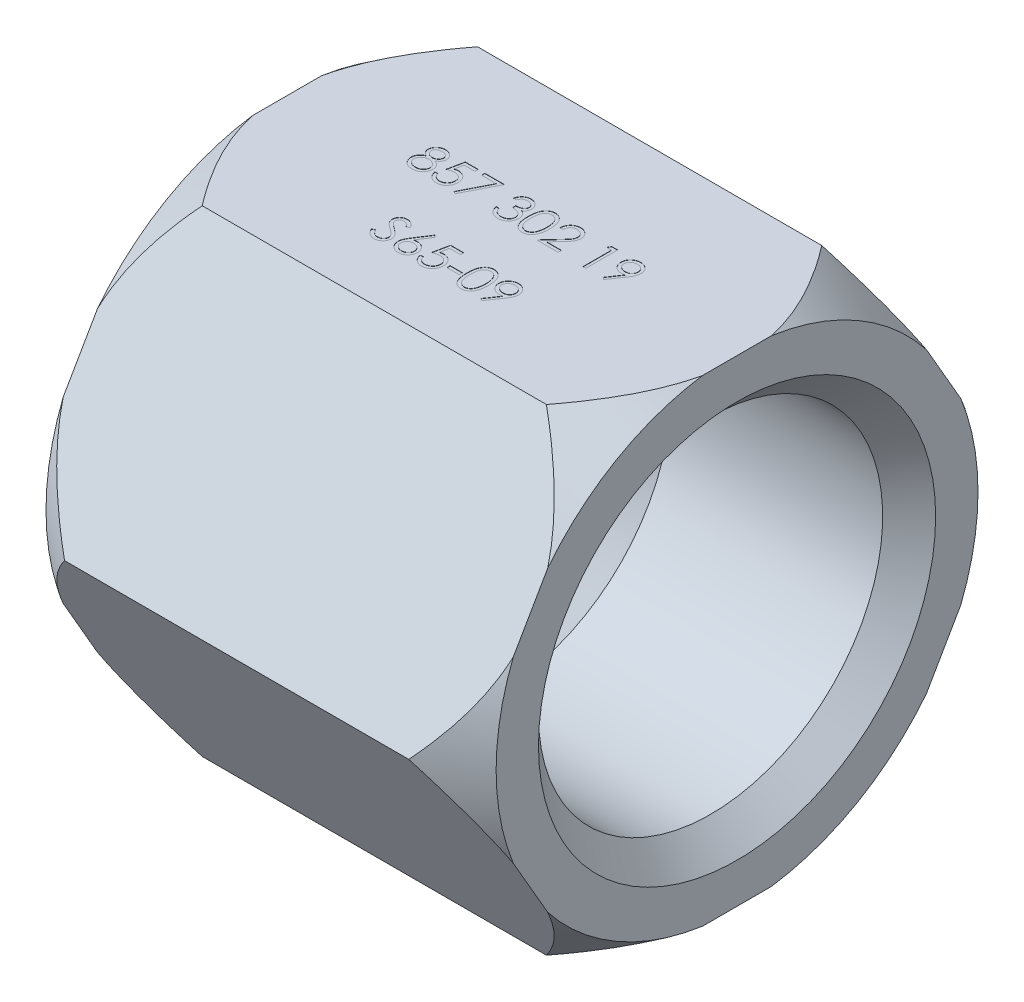
from build123d import *

# Parameters (mm, degrees)
SKETCH2_OUTSIDE_W  = 29.594
SKETCH2_OUTSIDE_H  = 29.594
EXTRUDE1_DEPTH     = 17
CHAMFER1_SIZE      = 1
SKETCH3_W          = 0.461538461
SKETCH3_H          = 0.123076923
CUT_EXTRUDE1_DEPTH = 0.01


with BuildPart() as part:
    # Sketch1 → Revolve1 (revolve)
    with BuildSketch(Plane.XY, mode=Mode.PRIVATE) as revolve1_sk:
        Polygon((0, 0), (0, 9.1), (2, 10.4), (15, 10.4), (17, 9.1), (17, 6.5), (8, 6.5), (3, 2.732229749), (1.358310741, 0), align=None)
    revolve(revolve1_sk.sketch.rotate(Axis((0, 0, 0), (1, 0, 0)), 90), axis=Axis((0, 0, 0), (1, 0, 0)))

    # Sketch2 outside → Extrude1 (cut)
    with BuildSketch(Plane(origin=(17, 0, 0), x_dir=(0, 0, -1), z_dir=(1, 0, 0))):
        Rectangle(SKETCH2_OUTSIDE_W, SKETCH2_OUTSIDE_H)
        Polygon((5.2, 9.006664199), (-5.2, 9.006664199), (-10.4, 0), (-5.2, -9.006664199), (5.2, -9.006664199), (10.4, 0), align=None, mode=Mode.SUBTRACT)
    extrude(amount=-EXTRUDE1_DEPTH, mode=Mode.SUBTRACT)

    # Chamfer1
    chamfer1_edges = [part.edges().sort_by_distance(p)[0] for p in [
        (17, 0, -6.5),
    ]]
    chamfer(chamfer1_edges, length=CHAMFER1_SIZE)

    # Sketch3 → Cut-Extrude1 (cut)
    # profile 1 of 14: a face of its own
    with BuildSketch(Plane(origin=(0, 9.006664199, 0), x_dir=(1, 0, 0), z_dir=(0, 1, 0))):
        with BuildLine():
            add(Edge.make_bspline(
                [(4.934478671, 0.668509615), (4.94430103, 0.66338803), (4.96345791, 0.653399229), (4.990741525, 0.637315517), (5.015675811, 0.620364329), (5.038952575, 0.60334632), (5.060162866, 0.585609754), (5.079069522, 0.5670841), (5.096139563, 0.548231776), (5.111028747, 0.528733545), (5.124124805, 0.508641209), (5.135443251, 0.487902029), (5.145117721, 0.466561458), (5.152785014, 0.444386545), (5.159101057, 0.421703026), (5.163446979, 0.398218004), (5.165784208, 0.37408623), (5.166226086, 0.357777098), (5.166449825, 0.349519231)],
                knots=[0, 0, 0, 0, 1.272397273, 2.481599622, 3.635517121, 4.734568067, 5.792894095, 6.808321871, 7.773003508, 8.711915296, 9.623354172, 10.525449501, 11.423591555, 12.311487226, 13.218079475, 14.126165749, 15.051214107, 16, 16, 16, 16], degree=3))
            add(Edge.make_bspline(
                [(5.166449825, 0.349519231), (5.166185338, 0.337965722), (5.165661819, 0.315096994), (5.161101824, 0.281344042), (5.154274517, 0.24856286), (5.144304399, 0.216760634), (5.131374093, 0.186112849), (5.115439178, 0.156593269), (5.097401051, 0.127718078), (5.082914569, 0.109951426), (5.07558444, 0.100961538)],
                knots=[0, 0, 0, 0, 1.025265484, 2.029385089, 3.018602448, 3.995076438, 4.983346944, 5.966715145, 6.97116228, 8, 8, 8, 8], degree=3))
            add(Edge.make_bspline(
                [(5.07558444, 0.100961538), (5.066040506, 0.090472244), (5.047070575, 0.069623276), (5.014573571, 0.042554426), (4.978908925, 0.019806063), (4.94021464, 0.001267127), (4.898594148, -0.01316231), (4.854056318, -0.023531173), (4.806514323, -0.029470292), (4.773838161, -0.030328803), (4.757074825, -0.030769231)],
                knots=[0, 0, 0, 0, 0.954267603, 1.896743057, 2.838368354, 3.796610408, 4.779680527, 5.799409237, 6.871065594, 8, 8, 8, 8], degree=3))
            add(Edge.make_bspline(
                [(4.757074825, -0.030769231), (4.740955949, -0.030374095), (4.709590253, -0.029605202), (4.663936124, -0.024395683), (4.621379642, -0.015266129), (4.581673368, -0.002770834), (4.545056673, 0.013484101), (4.511633895, 0.033715556), (4.480922819, 0.057109193), (4.453855457, 0.084336877), (4.429825133, 0.113499576), (4.408716086, 0.143585842), (4.391170688, 0.174598422), (4.376315684, 0.206074891), (4.36494379, 0.238456429), (4.357067604, 0.271576434), (4.352065553, 0.305377054), (4.351400021, 0.328187907), (4.351065209, 0.339663462)],
                knots=[0, 0, 0, 0, 1.256902934, 2.445805442, 3.576955095, 4.645999104, 5.686449165, 6.692658513, 7.68621702, 8.689161843, 9.678783111, 10.630372946, 11.551080876, 12.453998257, 13.34127905, 14.221779781, 15.105423033, 16, 16, 16, 16], degree=3))
            add(Edge.make_bspline(
                [(4.351065209, 0.339663462), (4.35126334, 0.348083756), (4.351654916, 0.36472523), (4.35436515, 0.389311285), (4.358722336, 0.413241389), (4.364639865, 0.436603929), (4.372659645, 0.459228823), (4.382342662, 0.481223271), (4.393633617, 0.502612105), (4.406690017, 0.523512292), (4.421879282, 0.543630982), (4.439078248, 0.563309609), (4.45863066, 0.582242821), (4.480319, 0.600661938), (4.503895414, 0.6188937), (4.529972281, 0.635952807), (4.557858316, 0.653046967), (4.577677312, 0.663266964), (4.587844056, 0.668509615)],
                knots=[0, 0, 0, 0, 0.941657376, 1.861047343, 2.762797495, 3.66048619, 4.553285746, 5.444104102, 6.34607688, 7.256116206, 8.197091036, 9.162375105, 10.176350973, 11.237807142, 12.343728897, 13.50695164, 14.721116704, 16, 16, 16, 16], degree=3))
            add(Edge.make_bspline(
                [(4.587844056, 0.668509615), (4.573927013, 0.676098679), (4.546979723, 0.69079323), (4.511298771, 0.717792135), (4.480650558, 0.747033672), (4.455877512, 0.779135315), (4.436378462, 0.813094244), (4.423000655, 0.848697987), (4.413950432, 0.885286369), (4.413053919, 0.91028278), (4.412603671, 0.922836538)],
                knots=[0, 0, 0, 0, 1.166880483, 2.259407225, 3.286803203, 4.280235371, 5.237608625, 6.161067461, 7.076446754, 8, 8, 8, 8], degree=3))
            add(Edge.make_bspline(
                [(4.412603671, 0.922836538), (4.413164388, 0.935624273), (4.414291526, 0.961329849), (4.423405808, 0.999594805), (4.438258402, 1.037177628), (4.458459887, 1.073896158), (4.483621218, 1.10850766), (4.513808605, 1.13955027), (4.548301164, 1.166742778), (4.586926718, 1.189568895), (4.628493428, 1.208146149), (4.672350247, 1.220961608), (4.717733045, 1.229339706), (4.748623692, 1.230288273), (4.764286363, 1.230769231)],
                knots=[0, 0, 0, 0, 0.888701115, 1.786444228, 2.72001202, 3.692817113, 4.693886446, 5.687152267, 6.695133018, 7.739871481, 8.800368666, 9.853104506, 10.91144658, 12, 12, 12, 12], degree=3))
            add(Edge.make_bspline(
                [(4.764286363, 1.230769231), (4.779544814, 1.230273342), (4.809632741, 1.229295505), (4.85385947, 1.221140004), (4.896176571, 1.207518454), (4.936438114, 1.189039406), (4.973923325, 1.166278169), (5.007044117, 1.138712155), (5.036301002, 1.107806481), (5.060501366, 1.073205474), (5.080442928, 1.036628036), (5.094328951, 0.998357458), (5.103226771, 0.959220637), (5.104349067, 0.932739036), (5.104911363, 0.919471154)],
                knots=[0, 0, 0, 0, 1.072916533, 2.115669174, 3.151510826, 4.193348718, 5.225979165, 6.227137561, 7.216255879, 8.211077061, 9.189680878, 10.138522389, 11.067357538, 12, 12, 12, 12], degree=3))
            add(Edge.make_bspline(
                [(5.104911363, 0.919471154), (5.104419514, 0.906450583), (5.10345355, 0.880878923), (5.095327856, 0.843601259), (5.081643291, 0.808690846), (5.062959578, 0.775751548), (5.038607983, 0.745380748), (5.00891356, 0.717192244), (4.974113053, 0.690954475), (4.947966464, 0.676147721), (4.934478671, 0.668509615)],
                knots=[0, 0, 0, 0, 0.975232327, 1.915300861, 2.843280834, 3.77672583, 4.742871857, 5.749627742, 6.839139064, 8, 8, 8, 8], degree=3))
        make_face()
        with BuildLine():
            add(Edge.make_bspline(
                [(4.758276748, 1.107692308), (4.749859329, 1.107468957), (4.733391176, 1.107031984), (4.709244203, 1.104749023), (4.686282249, 1.10030792), (4.664265403, 1.094397505), (4.643495524, 1.086413052), (4.623690534, 1.077020477), (4.605187498, 1.065601255), (4.587763051, 1.052791701), (4.572077071, 1.038702705), (4.558155511, 1.024023715), (4.546591586, 1.008466438), (4.536771777, 0.992417858), (4.529646685, 0.97540166), (4.524310352, 0.957939542), (4.520703018, 0.939810839), (4.520432713, 0.927421179), (4.520295979, 0.921153846)],
                knots=[0, 0, 0, 0, 1.203892937, 2.355340988, 3.463153438, 4.544400666, 5.610487187, 6.640501085, 7.674077295, 8.714426146, 9.728707835, 10.68524104, 11.601827946, 12.495867327, 13.368432065, 14.231010473, 15.105153427, 16, 16, 16, 16], degree=3))
            add(Edge.make_bspline(
                [(4.520295979, 0.921153846), (4.520531647, 0.914886243), (4.520997362, 0.902500558), (4.524599121, 0.884210547), (4.529967185, 0.866237415), (4.53841884, 0.849008531), (4.548555878, 0.831926236), (4.561067241, 0.815417464), (4.575977765, 0.799424761), (4.592787173, 0.784084152), (4.6110997, 0.769718862), (4.630499943, 0.757248057), (4.65074442, 0.746813505), (4.67162513, 0.738129137), (4.693354883, 0.731378302), (4.715800531, 0.726589051), (4.738965846, 0.723612367), (4.754662045, 0.723256817), (4.762603671, 0.723076923)],
                knots=[0, 0, 0, 0, 0.873023192, 1.725219244, 2.590779336, 3.480155217, 4.391973325, 5.357036234, 6.360879153, 7.436073238, 8.526419356, 9.601555421, 10.645666583, 11.697338044, 12.750135903, 13.812665442, 14.89329948, 16, 16, 16, 16], degree=3))
            add(Edge.make_bspline(
                [(4.762603671, 0.723076923), (4.772803706, 0.723376192), (4.793103033, 0.723971773), (4.823027375, 0.729509319), (4.852123139, 0.738219919), (4.880079334, 0.750137622), (4.906172335, 0.765095745), (4.929431787, 0.783004209), (4.949659293, 0.803449499), (4.966644645, 0.826113328), (4.979813735, 0.850233873), (4.990065784, 0.874439688), (4.996052486, 0.898989024), (4.996833366, 0.91543484), (4.997219056, 0.923557692)],
                knots=[0, 0, 0, 0, 1.076279235, 2.141928126, 3.20205304, 4.278698113, 5.344010996, 6.36967002, 7.368914609, 8.37248503, 9.349703398, 10.264243087, 11.142681841, 12, 12, 12, 12], degree=3))
            add(Edge.make_bspline(
                [(4.997219056, 0.923557692), (4.997036691, 0.929258733), (4.996674722, 0.940574482), (4.993691846, 0.957284779), (4.988762989, 0.973614922), (4.982089933, 0.989699815), (4.973309432, 1.00531378), (4.962898853, 1.020702267), (4.950252739, 1.035519101), (4.936059676, 1.050109574), (4.919964107, 1.063612668), (4.901997052, 1.075487426), (4.882250623, 1.085571662), (4.860724354, 1.093762093), (4.837497523, 1.099913755), (4.812677109, 1.104520503), (4.786056156, 1.107116999), (4.767737384, 1.107496379), (4.758276748, 1.107692308)],
                knots=[0, 0, 0, 0, 0.814439003, 1.616544685, 2.417341072, 3.248991801, 4.09997495, 4.973547432, 5.9003056, 6.880240646, 7.880314356, 8.896779544, 9.951930927, 11.043077905, 12.18215768, 13.381699519, 14.647792085, 16, 16, 16, 16], degree=3))
        make_face(mode=Mode.SUBTRACT)
        with BuildLine():
            add(Edge.make_bspline(
                [(4.765247902, 0.6), (4.754576204, 0.59981018), (4.733640936, 0.5994378), (4.70296999, 0.595292828), (4.673534619, 0.589522751), (4.645434069, 0.58076932), (4.618680207, 0.569387666), (4.593128202, 0.555695824), (4.568973529, 0.539511101), (4.546549737, 0.521039118), (4.526073167, 0.50113302), (4.508108035, 0.480060288), (4.492851743, 0.458212562), (4.480566057, 0.435312369), (4.470482034, 0.411844617), (4.463860133, 0.38722487), (4.459614975, 0.361926431), (4.45904493, 0.344728683), (4.458757517, 0.336057692)],
                knots=[0, 0, 0, 0, 1.140299081, 2.23698856, 3.303958914, 4.344563908, 5.37730929, 6.408454204, 7.439741482, 8.480804886, 9.510774543, 10.48932336, 11.43758569, 12.353841022, 13.263987381, 14.161954604, 15.073269652, 16, 16, 16, 16], degree=3))
            add(Edge.make_bspline(
                [(4.458757517, 0.336057692), (4.45922492, 0.325281382), (4.460152237, 0.303901433), (4.467508799, 0.272302666), (4.479315268, 0.24171259), (4.495781056, 0.212380492), (4.516169938, 0.184969027), (4.54124187, 0.161075732), (4.569438729, 0.139845511), (4.601714564, 0.122675042), (4.636970039, 0.108962521), (4.675195774, 0.099514762), (4.715843175, 0.093260551), (4.743909321, 0.092630317), (4.758276748, 0.092307692)],
                knots=[0, 0, 0, 0, 0.898778495, 1.783155532, 2.693654817, 3.627872908, 4.583023416, 5.533784346, 6.509005473, 7.520592997, 8.575161974, 9.658835044, 10.801527049, 12, 12, 12, 12], degree=3))
            add(Edge.make_bspline(
                [(4.758276748, 0.092307692), (4.769505445, 0.092523284), (4.791382549, 0.092943325), (4.823297732, 0.096651083), (4.853415862, 0.102530954), (4.881678536, 0.111083027), (4.908402138, 0.121523019), (4.933133574, 0.134953447), (4.956509069, 0.150228529), (4.977376768, 0.168351326), (4.99638244, 0.187715724), (5.012953854, 0.208215167), (5.027339301, 0.229292527), (5.038629914, 0.251424122), (5.047656058, 0.27418535), (5.054144134, 0.297786096), (5.058147408, 0.322298748), (5.058552286, 0.338927001), (5.058757517, 0.347355769)],
                knots=[0, 0, 0, 0, 1.224942928, 2.386581632, 3.501229538, 4.569074225, 5.605009692, 6.626002462, 7.634866581, 8.645888296, 9.63523824, 10.59253846, 11.518950513, 12.414518923, 13.29783783, 14.186679152, 15.080837789, 16, 16, 16, 16], degree=3))
            add(Edge.make_bspline(
                [(5.058757517, 0.347355769), (5.05844694, 0.355542286), (5.057834538, 0.371684667), (5.053947672, 0.395604619), (5.047119371, 0.418714155), (5.037749978, 0.4412913), (5.025276505, 0.462878598), (5.010586835, 0.484038428), (4.992863138, 0.504183495), (4.972835962, 0.52347027), (4.951010032, 0.541304237), (4.927809868, 0.557080616), (4.903414053, 0.570367056), (4.877874209, 0.581172712), (4.851247047, 0.589671273), (4.823552152, 0.595608185), (4.794757097, 0.599345192), (4.775195427, 0.599779265), (4.765247902, 0.6)],
                knots=[0, 0, 0, 0, 0.917430815, 1.809013306, 2.70690318, 3.612392954, 4.541220862, 5.495268465, 6.494511384, 7.542276156, 8.608045339, 9.649016899, 10.681629292, 11.715607085, 12.752076957, 13.808767841, 14.885711793, 16, 16, 16, 16], degree=3))
        make_face(mode=Mode.SUBTRACT)
    # profile 2 of 14: a face of its own
    with BuildSketch(Plane(origin=(0, 9.006664199, 0), x_dir=(1, 0, 0), z_dir=(0, 1, 0))):
        with BuildLine():
            Line((6.027988286, 1.2), (6.027988286, 1.076923077))
            Line((6.027988286, 1.076923077), (5.620055594, 1.076923077))
            Line((5.620055594, 1.076923077), (5.555151748, 0.761298077))
            add(Edge.make_bspline(
                [(5.555151748, 0.761298077), (5.567856619, 0.764805599), (5.592470298, 0.771600867), (5.628799393, 0.779145703), (5.663288148, 0.783693855), (5.685668275, 0.784314876), (5.696497902, 0.784615385)],
                knots=[0, 0, 0, 0, 1.100273476, 2.13160584, 3.095893838, 4, 4, 4, 4], degree=3))
            add(Edge.make_bspline(
                [(5.696497902, 0.784615385), (5.709898041, 0.78432535), (5.736246063, 0.783755068), (5.774796559, 0.778279005), (5.811596408, 0.769659606), (5.846568649, 0.757618284), (5.879777981, 0.742220662), (5.910918859, 0.722986396), (5.940458715, 0.700517826), (5.967867604, 0.67468525), (5.992733082, 0.646254981), (6.014595707, 0.615686569), (6.033165738, 0.583277084), (6.048100854, 0.548716876), (6.060026911, 0.512388023), (6.067964738, 0.47390828), (6.073250467, 0.433640354), (6.073840999, 0.406107358), (6.074142132, 0.392067308)],
                knots=[0, 0, 0, 0, 1.052922333, 2.070308379, 3.05430497, 4.020497103, 4.973039431, 5.925935799, 6.892292201, 7.88610001, 8.88166317, 9.857072816, 10.836096531, 11.812156883, 12.81219415, 13.836441305, 14.89672472, 16, 16, 16, 16], degree=3))
            add(Edge.make_bspline(
                [(6.074142132, 0.392067308), (6.073914107, 0.382288261), (6.073461137, 0.362862322), (6.071157621, 0.334012882), (6.066722518, 0.305774196), (6.06076787, 0.278142519), (6.053039041, 0.251170163), (6.043682794, 0.224779925), (6.032232727, 0.19913606), (6.019673399, 0.173995924), (6.005531749, 0.149927865), (5.989836261, 0.127419641), (5.973253807, 0.106133601), (5.955411046, 0.086298036), (5.936142133, 0.068043287), (5.91568043, 0.051261019), (5.894189212, 0.03566742), (5.871335986, 0.021895467), (5.847629992, 0.009222454), (5.822728889, -0.001174188), (5.797199506, -0.010469226), (5.770674406, -0.017878207), (5.74321367, -0.023683654), (5.714772033, -0.027626717), (5.68549866, -0.030498639), (5.665655799, -0.030678418), (5.655632517, -0.030769231)],
                knots=[0, 0, 0, 0, 1.056347294, 2.098418968, 3.122841568, 4.141288669, 5.149314143, 6.15115421, 7.162517403, 8.180376062, 9.185164535, 10.17417709, 11.141909838, 12.097768115, 13.052685741, 14.0056014, 14.954263652, 15.917497458, 16.885230207, 17.854509472, 18.828990115, 19.81800267, 20.826176721, 21.857883937, 22.917946725, 24, 24, 24, 24], degree=3))
            add(Edge.make_bspline(
                [(5.655632517, -0.030769231), (5.643675655, -0.030532372), (5.620151942, -0.03006638), (5.585687747, -0.025191471), (5.552528454, -0.018209557), (5.520940991, -0.007705693), (5.490642272, 0.005455665), (5.462040197, 0.022089781), (5.434403931, 0.040939759), (5.408856947, 0.063184452), (5.385146279, 0.0874984), (5.363921191, 0.113883877), (5.34501825, 0.1419054), (5.328740165, 0.171699053), (5.31485513, 0.203186549), (5.303947134, 0.236485864), (5.295143126, 0.271423008), (5.291418525, 0.29547564), (5.289526748, 0.307692308)],
                knots=[0, 0, 0, 0, 1.0467383, 2.05933395, 3.04377827, 4.011590433, 4.970194871, 5.932262533, 6.905835911, 7.896367577, 8.894135286, 9.877477877, 10.858688626, 11.851381753, 12.8477658, 13.868841284, 14.917554742, 16, 16, 16, 16], degree=3))
            Line((5.289526748, 0.307692308), (5.397219056, 0.307692308))
            add(Edge.make_bspline(
                [(5.397219056, 0.307692308), (5.399868847, 0.296248953), (5.404961892, 0.274254189), (5.416141006, 0.243352014), (5.429809306, 0.215813995), (5.446062226, 0.191275852), (5.465450808, 0.169878482), (5.487575183, 0.150809775), (5.512380117, 0.133606873), (5.53994351, 0.119267639), (5.56902228, 0.107038352), (5.599456752, 0.098894914), (5.630418242, 0.093168893), (5.651359398, 0.092595718), (5.661882517, 0.092307692)],
                knots=[0, 0, 0, 0, 1.136247022, 2.183929868, 3.172523383, 4.106158343, 5.02341133, 5.958108904, 6.928429099, 7.938127109, 8.96079061, 9.975095812, 10.982467395, 12, 12, 12, 12], degree=3))
            add(Edge.make_bspline(
                [(5.661882517, 0.092307692), (5.672153984, 0.092589102), (5.692378586, 0.0931432), (5.72214249, 0.097408004), (5.750878332, 0.103976314), (5.778302569, 0.113805978), (5.804895097, 0.125752739), (5.829983247, 0.141083622), (5.854292804, 0.158727057), (5.877068164, 0.178940759), (5.897927404, 0.201216083), (5.916358074, 0.225036903), (5.931710159, 0.250448394), (5.944647568, 0.277010617), (5.954471556, 0.305014694), (5.961479892, 0.334329383), (5.965595227, 0.36502709), (5.966161346, 0.385965139), (5.966449825, 0.396634615)],
                knots=[0, 0, 0, 0, 1.027316725, 2.022795036, 3.002884548, 3.971462791, 4.93288096, 5.914575861, 6.907176829, 7.935150275, 8.956128384, 9.956726525, 10.942570165, 11.921478529, 12.907843606, 13.90538589, 14.932640048, 16, 16, 16, 16], degree=3))
            add(Edge.make_bspline(
                [(5.966449825, 0.396634615), (5.96622406, 0.406260587), (5.965782159, 0.425102058), (5.962171677, 0.4526675), (5.955891573, 0.478749686), (5.947174814, 0.503474566), (5.936107554, 0.526865461), (5.922583104, 0.54894651), (5.906347653, 0.569426681), (5.887801863, 0.588315557), (5.86748482, 0.605748085), (5.845046966, 0.620608915), (5.820957848, 0.63311083), (5.7955077, 0.643899858), (5.768091163, 0.651648685), (5.739251175, 0.657466245), (5.708676303, 0.660831513), (5.687772067, 0.661298446), (5.677026748, 0.661538462)],
                knots=[0, 0, 0, 0, 1.045622112, 2.046656509, 3.013763289, 3.955457236, 4.890082067, 5.820317437, 6.762574623, 7.722996705, 8.69280354, 9.665887285, 10.63943826, 11.638615906, 12.663482002, 13.728887084, 14.832589034, 16, 16, 16, 16], degree=3))
            add(Edge.make_bspline(
                [(5.677026748, 0.661538462), (5.667725401, 0.661339402), (5.648520479, 0.660928394), (5.619061224, 0.657902166), (5.588104062, 0.653020122), (5.555767663, 0.646304838), (5.521954918, 0.63751704), (5.48673718, 0.626986354), (5.450040403, 0.614395954), (5.425314326, 0.604887767), (5.412603671, 0.6)],
                knots=[0, 0, 0, 0, 0.817624296, 1.688186739, 2.600797293, 3.572016777, 4.590301741, 5.671205678, 6.80286297, 8, 8, 8, 8], degree=3))
            Line((5.412603671, 0.6), (5.535680594, 1.2))
            Line((5.535680594, 1.2), (6.027988286, 1.2))
        make_face()
    # profile 3 of 14: a face of its own
    with BuildSketch(Plane(origin=(0, 9.006664199, 0), x_dir=(1, 0, 0), z_dir=(0, 1, 0))):
        Polygon((6.274142132, 1.2), (7.012603671, 1.2), (6.38183444, -0.030769231), (6.288805594, 0.020432692), (6.830151748, 1.076923077), (6.274142132, 1.076923077), align=None)
    # profile 4 of 14: a face of its own
    with BuildSketch(Plane(origin=(0, 9.006664199, 0), x_dir=(1, 0, 0), z_dir=(0, 1, 0))):
        with BuildLine():
            Line((7.735680594, 0.923076923), (7.627988286, 0.923076923))
            add(Edge.make_bspline(
                [(7.627988286, 0.923076923), (7.630905847, 0.935156632), (7.636609438, 0.958771475), (7.648505749, 0.992511107), (7.661465494, 1.024439171), (7.677027472, 1.053957825), (7.694001902, 1.081660306), (7.713449693, 1.106918292), (7.734473598, 1.130374165), (7.757727866, 1.151190133), (7.782114836, 1.17003964), (7.807978134, 1.186111088), (7.834797412, 1.199936512), (7.862758486, 1.211326306), (7.891944602, 1.219906485), (7.922091901, 1.226131676), (7.953279387, 1.230174343), (7.974449989, 1.230568891), (7.985199825, 1.230769231)],
                knots=[0, 0, 0, 0, 1.162005537, 2.271625781, 3.343758855, 4.383309926, 5.390229558, 6.379919256, 7.361854164, 8.333198761, 9.295911338, 10.242430842, 11.177959212, 12.116337295, 13.062827104, 14.020064771, 14.994644689, 16, 16, 16, 16], degree=3))
            add(Edge.make_bspline(
                [(7.985199825, 1.230769231), (8.000862479, 1.230296352), (8.03184614, 1.229360909), (8.077364899, 1.220818816), (8.121259808, 1.207301628), (8.163050408, 1.188624922), (8.201868156, 1.165589271), (8.236406277, 1.13817279), (8.266196624, 1.106904458), (8.291188982, 1.072367579), (8.310757553, 1.035457119), (8.325187167, 0.997468493), (8.333971743, 0.958491817), (8.33511022, 0.932175036), (8.335680594, 0.918990385)],
                knots=[0, 0, 0, 0, 1.083050992, 2.142477498, 3.193116406, 4.255571735, 5.30263384, 6.308962982, 7.297363603, 8.282367274, 9.249857812, 10.179914175, 11.08814088, 12, 12, 12, 12], degree=3))
            add(Edge.make_bspline(
                [(8.335680594, 0.918990385), (8.335281648, 0.906302341), (8.334500974, 0.881473808), (8.327872275, 0.845226437), (8.316716985, 0.811063603), (8.301264495, 0.77884149), (8.281261678, 0.748764402), (8.257031039, 0.720764668), (8.228401555, 0.6947181), (8.206705919, 0.679797138), (8.195536363, 0.672115385)],
                knots=[0, 0, 0, 0, 1.024540389, 2.004866551, 2.965041327, 3.920577974, 4.882998113, 5.874504559, 6.905732034, 8, 8, 8, 8], degree=3))
            add(Edge.make_bspline(
                [(8.195536363, 0.672115385), (8.208301536, 0.66595144), (8.233593036, 0.653738883), (8.268067503, 0.629788338), (8.299362775, 0.602134733), (8.316815478, 0.580554395), (8.32558444, 0.569711538)],
                knots=[0, 0, 0, 0, 1.015518401, 2.012035669, 3.001164323, 4, 4, 4, 4], degree=3))
            add(Edge.make_bspline(
                [(8.32558444, 0.569711538), (8.331358615, 0.561806024), (8.342812408, 0.546124452), (8.356950305, 0.520911963), (8.369776287, 0.495420024), (8.379770648, 0.468965371), (8.387510259, 0.441854623), (8.393042613, 0.41404123), (8.396479462, 0.38550248), (8.396971651, 0.366195344), (8.397219056, 0.356490385)],
                knots=[0, 0, 0, 0, 1.025084078, 2.033381695, 3.024893161, 4.013698104, 4.991890475, 5.976764909, 6.982997093, 8, 8, 8, 8], degree=3))
            add(Edge.make_bspline(
                [(8.397219056, 0.356490385), (8.396603794, 0.339687052), (8.395376166, 0.306159462), (8.38440334, 0.256625272), (8.367393086, 0.2082051), (8.343236422, 0.161893726), (8.313796134, 0.11856331), (8.278770765, 0.07979429), (8.238558283, 0.046469054), (8.193710631, 0.018625547), (8.145121902, -0.003632026), (8.093153127, -0.019080292), (8.038553109, -0.029141778), (8.001110607, -0.030220704), (7.982074825, -0.030769231)],
                knots=[0, 0, 0, 0, 0.955779014, 1.907060117, 2.875433937, 3.871313158, 4.872415639, 5.851225146, 6.836215519, 7.83643374, 8.849228613, 9.86973379, 10.916971861, 12, 12, 12, 12], degree=3))
            add(Edge.make_bspline(
                [(7.982074825, -0.030769231), (7.96924535, -0.030471558), (7.944001223, -0.029885836), (7.906889166, -0.025881744), (7.871464584, -0.0185686), (7.837679579, -0.008727466), (7.805504138, 0.003749702), (7.775036444, 0.019287542), (7.746089052, 0.037565771), (7.718935126, 0.058800144), (7.693577903, 0.082553746), (7.670691255, 0.109248264), (7.649893611, 0.138390231), (7.63174185, 0.170318136), (7.61540918, 0.204619367), (7.601975709, 0.241733138), (7.590152086, 0.28132766), (7.584654898, 0.308920028), (7.58183444, 0.323076923)],
                knots=[0, 0, 0, 0, 1.048658725, 2.063410685, 3.046034179, 4.001477787, 4.936774919, 5.862367409, 6.792675028, 7.730719943, 8.675894397, 9.627829632, 10.600096036, 11.597688215, 12.626045268, 13.701542398, 14.82072376, 16, 16, 16, 16], degree=3))
            Line((7.58183444, 0.323076923), (7.689526748, 0.323076923))
            add(Edge.make_bspline(
                [(7.689526748, 0.323076923), (7.692332448, 0.313837261), (7.697789778, 0.295865317), (7.707079251, 0.270000069), (7.717662659, 0.246288737), (7.729016222, 0.224557381), (7.740940261, 0.204591985), (7.754282521, 0.186920487), (7.768054799, 0.170766704), (7.778436292, 0.161665694), (7.783517132, 0.157211538)],
                knots=[0, 0, 0, 0, 1.198163088, 2.33053128, 3.407730985, 4.417276592, 5.372219308, 6.28897303, 7.162600585, 8, 8, 8, 8], degree=3))
            add(Edge.make_bspline(
                [(7.783517132, 0.157211538), (7.790235959, 0.152031538), (7.803652872, 0.141687527), (7.825516265, 0.128486969), (7.84850994, 0.117048903), (7.873132114, 0.108311636), (7.898851464, 0.100913581), (7.926083704, 0.09607226), (7.954588578, 0.092750601), (7.974051811, 0.092457482), (7.983997902, 0.092307692)],
                knots=[0, 0, 0, 0, 0.946170439, 1.889420265, 2.845303464, 3.807233317, 4.801018734, 5.828864929, 6.890507805, 8, 8, 8, 8], degree=3))
            add(Edge.make_bspline(
                [(7.983997902, 0.092307692), (7.995227674, 0.09251886), (8.017186524, 0.09293178), (8.04922819, 0.096729165), (8.079710744, 0.102259592), (8.108295747, 0.110801186), (8.135357635, 0.121354621), (8.160517058, 0.134605503), (8.184104294, 0.150152265), (8.205817233, 0.167822833), (8.225341407, 0.187167346), (8.242532098, 0.207400399), (8.257146267, 0.228436683), (8.268934923, 0.250392611), (8.278243683, 0.273177261), (8.28458078, 0.296854573), (8.288987014, 0.321230779), (8.289345852, 0.337800711), (8.289526748, 0.346153846)],
                knots=[0, 0, 0, 0, 1.217147791, 2.380027433, 3.494444702, 4.572153297, 5.609568379, 6.639424714, 7.649109417, 8.668170816, 9.669597737, 10.625200337, 11.543417969, 12.441394052, 13.322311151, 14.205496177, 15.095365482, 16, 16, 16, 16], degree=3))
            add(Edge.make_bspline(
                [(8.289526748, 0.346153846), (8.289002073, 0.357334877), (8.287955334, 0.379641302), (8.279963821, 0.412458756), (8.266819068, 0.444078212), (8.248417064, 0.473960197), (8.226016243, 0.501654792), (8.199833989, 0.526365015), (8.169652882, 0.54675476), (8.141874641, 0.560842299), (8.117269445, 0.570455011), (8.096212741, 0.576857856), (8.072639049, 0.582279681), (8.046833443, 0.587323888), (8.018601484, 0.591616922), (7.987973905, 0.595196973), (7.954944501, 0.598061558), (7.932078958, 0.599340791), (7.920295979, 0.6)],
                knots=[0, 0, 0, 0, 1.07054697, 2.135767047, 3.216561865, 4.33974944, 5.486079747, 6.621378074, 7.775625952, 8.963672916, 9.598146892, 10.304877434, 11.070270905, 11.915000392, 12.823868403, 13.805723172, 14.86925407, 16, 16, 16, 16], degree=3))
            Line((7.920295979, 0.6), (7.920295979, 0.723076923))
            add(Edge.make_bspline(
                [(7.920295979, 0.723076923), (7.935142093, 0.723328856), (7.964221983, 0.72382233), (8.00670003, 0.729790791), (8.047319451, 0.738047006), (8.085180049, 0.750693358), (8.119688179, 0.76538146), (8.149626328, 0.782473646), (8.174575065, 0.801472988), (8.194413146, 0.82267274), (8.209337453, 0.845409328), (8.220249498, 0.869106467), (8.226695324, 0.89397186), (8.227555781, 0.91094146), (8.227988286, 0.919471154)],
                knots=[0, 0, 0, 0, 1.321986639, 2.589447074, 3.816329219, 5.01088745, 6.139805852, 7.153945165, 8.075214402, 8.924034688, 9.728124013, 10.488707548, 11.240355623, 12, 12, 12, 12], degree=3))
            add(Edge.make_bspline(
                [(8.227988286, 0.919471154), (8.227846203, 0.925737809), (8.227563534, 0.938205023), (8.223998753, 0.956419332), (8.218641939, 0.9740768), (8.21127746, 0.991102335), (8.201420249, 1.007377857), (8.189623911, 1.023042125), (8.175577705, 1.038005707), (8.159482123, 1.051953245), (8.142198076, 1.065245555), (8.123255296, 1.07653023), (8.103224939, 1.086179966), (8.082084828, 1.094137509), (8.059766361, 1.100123551), (8.036374398, 1.104421554), (8.011864335, 1.10710875), (7.995142599, 1.107495635), (7.986642132, 1.107692308)],
                knots=[0, 0, 0, 0, 0.884392785, 1.759457502, 2.611959086, 3.489218968, 4.37281399, 5.2945488, 6.255912374, 7.266815255, 8.301784654, 9.332968512, 10.37626691, 11.440494194, 12.520033166, 13.637162961, 14.798855837, 16, 16, 16, 16], degree=3))
            add(Edge.make_bspline(
                [(7.986642132, 1.107692308), (7.972978703, 1.107215269), (7.946290849, 1.106283502), (7.907817163, 1.098122469), (7.872050534, 1.085101412), (7.844711563, 1.069558662), (7.824523252, 1.054215657), (7.810096873, 1.040815981), (7.795929841, 1.025924727), (7.78295418, 1.008624713), (7.769831674, 0.990087528), (7.757884967, 0.969370837), (7.746275929, 0.947015045), (7.73928077, 0.931210827), (7.735680594, 0.923076923)],
                knots=[0, 0, 0, 0, 1.472543308, 2.876219568, 4.221790263, 5.565193594, 6.249813518, 6.953379497, 7.687249741, 8.463570142, 9.283606569, 10.136032583, 11.040678096, 12, 12, 12, 12], degree=3))
        make_face()
    # profile 5 of 14: a face of its own
    with BuildSketch(Plane(origin=(0, 9.006664199, 0), x_dir=(1, 0, 0), z_dir=(0, 1, 0))):
        with BuildLine():
            add(Edge.make_bspline(
                [(8.504911363, 0.599519231), (8.505023827, 0.618752621), (8.505242288, 0.656113758), (8.507672604, 0.710554207), (8.511709864, 0.761626306), (8.517242678, 0.8093325), (8.5239757, 0.853685105), (8.532963866, 0.894565593), (8.543185399, 0.932163173), (8.555031952, 0.966600446), (8.568399194, 0.998341373), (8.582948083, 1.027972871), (8.599256012, 1.055450105), (8.616390954, 1.081211633), (8.635046521, 1.104835757), (8.654691821, 1.126656098), (8.676093607, 1.146168356), (8.698524353, 1.163944231), (8.722187141, 1.179526907), (8.746407483, 1.193252417), (8.771352091, 1.204978086), (8.797089068, 1.214197664), (8.823387088, 1.221812811), (8.850338082, 1.227020451), (8.87798655, 1.230297105), (8.896648756, 1.230610362), (8.906113286, 1.230769231)],
                knots=[0, 0, 0, 0, 1.646270934, 3.197905019, 4.663502075, 6.030701355, 7.308322542, 8.50163776, 9.611534131, 10.641858119, 11.616356847, 12.558055219, 13.465016945, 14.349605745, 15.204443733, 16.039544428, 16.859896111, 17.680448484, 18.487036065, 19.28249412, 20.06191084, 20.843045899, 21.620316918, 22.403196591, 23.190181807, 24, 24, 24, 24], degree=3))
            add(Edge.make_bspline(
                [(8.906113286, 1.230769231), (8.915656879, 1.23060198), (8.934636082, 1.23026937), (8.962695639, 1.22707259), (8.990106959, 1.221768205), (9.016753178, 1.214252442), (9.042853173, 1.20492821), (9.068202798, 1.193241199), (9.092959512, 1.179637016), (9.116729896, 1.163651686), (9.139774907, 1.145829192), (9.161528495, 1.125681991), (9.181992638, 1.103413516), (9.201424172, 1.079262019), (9.219271805, 1.052764276), (9.23626841, 1.024381153), (9.25148168, 0.993616285), (9.266133568, 0.960982982), (9.278780535, 0.925578299), (9.290186105, 0.887601809), (9.299401752, 0.846604945), (9.307078074, 0.802802804), (9.313024895, 0.756034524), (9.317356087, 0.706400359), (9.319644001, 0.653867653), (9.32007487, 0.617950676), (9.320295979, 0.599519231)],
                knots=[0, 0, 0, 0, 0.810914788, 1.612654377, 2.396697861, 3.181598691, 3.963628158, 4.749916497, 5.551656086, 6.361998678, 7.18212741, 8.025565596, 8.878627764, 9.750805457, 10.657531673, 11.591944965, 12.560506719, 13.57287815, 14.630710178, 15.753379473, 16.941251878, 18.199788006, 19.531962791, 20.947069417, 22.433333509, 24, 24, 24, 24], degree=3))
            add(Edge.make_bspline(
                [(9.320295979, 0.599519231), (9.320072578, 0.581168177), (9.319637292, 0.545411896), (9.317381735, 0.493115562), (9.312938776, 0.443744804), (9.307381065, 0.397181217), (9.299683592, 0.353618605), (9.290218964, 0.312906222), (9.279710282, 0.274868255), (9.266738352, 0.239816319), (9.252540395, 0.207261443), (9.237092899, 0.176861278), (9.220543244, 0.14834712), (9.202512817, 0.121947207), (9.183294504, 0.097474525), (9.162476977, 0.075361054), (9.140647062, 0.055073967), (9.117534233, 0.03702198), (9.09339313, 0.021221476), (9.068721447, 0.007091013), (9.043081429, -0.004303054), (9.017054131, -0.014086497), (8.990267263, -0.021560938), (8.962754215, -0.026729117), (8.934654934, -0.03035375), (8.915660112, -0.030630258), (8.906113286, -0.030769231)],
                knots=[0, 0, 0, 0, 1.561518951, 3.042555995, 4.452378317, 5.7783523, 7.031515105, 8.214008947, 9.334062868, 10.386615937, 11.391082383, 12.354592575, 13.286541444, 14.194233754, 15.072674879, 15.931287219, 16.775624067, 17.606195743, 18.42308326, 19.229000347, 20.022332153, 20.807536673, 21.593273796, 22.3848459, 23.188221202, 24, 24, 24, 24], degree=3))
            add(Edge.make_bspline(
                [(8.906113286, -0.030769231), (8.896649019, -0.030609337), (8.87798733, -0.030294059), (8.85033507, -0.027032208), (8.823495375, -0.021788036), (8.797335802, -0.0144452), (8.77172214, -0.005457256), (8.747003413, 0.006252578), (8.722904779, 0.019738545), (8.699490531, 0.035096975), (8.677200647, 0.052692981), (8.655909697, 0.072155022), (8.636152547, 0.093968763), (8.617763715, 0.117789766), (8.600286884, 0.143398877), (8.584210528, 0.171145748), (8.569340521, 0.200920357), (8.555748467, 0.23291507), (8.543697496, 0.267596759), (8.533052568, 0.305362192), (8.524647714, 0.346544696), (8.517453558, 0.390813507), (8.511650912, 0.438358855), (8.507689429, 0.48920655), (8.505240978, 0.543324907), (8.50502324, 0.580445973), (8.504911363, 0.599519231)],
                knots=[0, 0, 0, 0, 0.810891512, 1.598919785, 2.382837074, 3.152667961, 3.926044502, 4.706494248, 5.493654104, 6.291793342, 7.103789334, 7.925228297, 8.761435821, 9.622817696, 10.50288917, 11.416980706, 12.369136599, 13.353924996, 14.394355917, 15.514179734, 16.714354668, 17.994756427, 19.357759367, 20.818452758, 22.365282078, 24, 24, 24, 24], degree=3))
        make_face()
        with BuildLine():
            add(Edge.make_bspline(
                [(8.612603671, 0.6), (8.612644624, 0.583971875), (8.612724106, 0.552864431), (8.614800518, 0.507661027), (8.617629169, 0.465499771), (8.621277614, 0.42632713), (8.626695768, 0.390275697), (8.632766666, 0.35709752), (8.640154583, 0.326968182), (8.648895732, 0.299680933), (8.658851993, 0.274772681), (8.669722575, 0.251595121), (8.681400537, 0.229874457), (8.694469961, 0.209805791), (8.708703696, 0.191323678), (8.723780242, 0.174100993), (8.740262271, 0.158742028), (8.763063554, 0.140321392), (8.793165203, 0.12128626), (8.831092216, 0.104710458), (8.870064256, 0.094293616), (8.896516114, 0.092968899), (8.909719056, 0.092307692)],
                knots=[0, 0, 0, 0, 1.459021318, 2.831673884, 4.118529203, 5.306027144, 6.411944654, 7.436330062, 8.375795394, 9.233974572, 10.042671642, 10.816086306, 11.563610507, 12.285937304, 12.993564865, 13.685989202, 14.367179055, 15.041617293, 16.353048772, 17.594441528, 18.799311195, 20, 20, 20, 20], degree=3))
            add(Edge.make_bspline(
                [(8.909719056, 0.092307692), (8.9230074, 0.092855503), (8.949556654, 0.093949993), (8.988345384, 0.10450956), (9.026001476, 0.120441974), (9.055511856, 0.139281118), (9.077963013, 0.15722226), (9.094048839, 0.172518711), (9.108812969, 0.189646437), (9.122815967, 0.208126195), (9.135659078, 0.228311047), (9.147337868, 0.25010393), (9.157995016, 0.273565362), (9.164066689, 0.289943559), (9.167170979, 0.298317308)],
                knots=[0, 0, 0, 0, 1.353760809, 2.704726607, 4.075137775, 5.516104923, 6.260822281, 7.007110065, 7.778089737, 8.566572457, 9.372053459, 10.217411131, 11.088608312, 12, 12, 12, 12], degree=3))
            add(Edge.make_bspline(
                [(9.167170979, 0.298317308), (9.170788728, 0.309024647), (9.178134309, 0.330765138), (9.187601203, 0.364489818), (9.195056769, 0.399873623), (9.201764209, 0.436705092), (9.206342399, 0.475255846), (9.210027364, 0.515406606), (9.212197885, 0.557187645), (9.212466942, 0.585574499), (9.212603671, 0.6)],
                knots=[0, 0, 0, 0, 0.884706709, 1.796334032, 2.740027952, 3.714592787, 4.726048262, 5.777819803, 6.87074269, 8, 8, 8, 8], degree=3))
            add(Edge.make_bspline(
                [(9.212603671, 0.6), (9.212415035, 0.614423168), (9.212046022, 0.642637967), (9.210635512, 0.683958486), (9.206993143, 0.723204576), (9.202947731, 0.760545309), (9.196982969, 0.795773984), (9.190551721, 0.829185518), (9.181911306, 0.860365983), (9.172681669, 0.889803554), (9.162118104, 0.917163778), (9.150489853, 0.94257422), (9.138070964, 0.966157554), (9.124582196, 0.987849077), (9.110183676, 1.007745948), (9.094495373, 1.025449238), (9.078139588, 1.041507627), (9.055230839, 1.059837651), (9.025239654, 1.078527375), (8.987921146, 1.095727064), (8.949085497, 1.105604193), (8.922831741, 1.106996771), (8.909719056, 1.107692308)],
                knots=[0, 0, 0, 0, 1.31362396, 2.569729283, 3.763502607, 4.902122613, 5.988968491, 7.01645872, 7.998833611, 8.933434873, 9.825090667, 10.667526885, 11.477055099, 12.250526234, 12.991942729, 13.710640831, 14.402115721, 15.076753259, 16.378508321, 17.609869233, 18.806226677, 20, 20, 20, 20], degree=3))
            add(Edge.make_bspline(
                [(8.909719056, 1.107692308), (8.896446853, 1.106995812), (8.869878268, 1.105601551), (8.830638969, 1.095763864), (8.793026048, 1.078616561), (8.763114171, 1.059775748), (8.740189445, 1.041831184), (8.724046807, 1.026270114), (8.708910976, 1.009248541), (8.694967765, 0.990596456), (8.681908582, 0.970551187), (8.669915092, 0.948955039), (8.65910915, 0.925698572), (8.649137309, 0.900801508), (8.640369496, 0.873516613), (8.63313728, 0.843424386), (8.626456005, 0.810351738), (8.621726199, 0.774105049), (8.617521482, 0.734922597), (8.614819306, 0.692656088), (8.612717161, 0.647376871), (8.612642258, 0.616108589), (8.612603671, 0.6)],
                knots=[0, 0, 0, 0, 1.207732386, 2.417664972, 3.655092373, 4.956220595, 5.625982001, 6.301752483, 6.994047911, 7.697131622, 8.419323945, 9.170223765, 9.943494443, 10.752040957, 11.610060368, 12.549350801, 13.567764191, 14.679664412, 15.874934091, 17.154273443, 18.533957287, 20, 20, 20, 20], degree=3))
        make_face(mode=Mode.SUBTRACT)
    # profile 6 of 14: a face of its own
    with BuildSketch(Plane(origin=(0, 9.006664199, 0), x_dir=(1, 0, 0), z_dir=(0, 1, 0))):
        with BuildLine():
            Line((9.58183444, 0.830769231), (9.474142132, 0.830769231))
            add(Edge.make_bspline(
                [(9.474142132, 0.830769231), (9.474844013, 0.845056392), (9.476222489, 0.873115997), (9.482677903, 0.914027051), (9.491914775, 0.953131553), (9.504974702, 0.990115524), (9.521193997, 1.025305972), (9.540644292, 1.05856312), (9.563682184, 1.089760099), (9.589810207, 1.118607703), (9.618188026, 1.145072013), (9.648807205, 1.167925239), (9.680982643, 1.187234155), (9.714616723, 1.203376295), (9.750088916, 1.215492813), (9.787077324, 1.22448309), (9.825744457, 1.229892123), (9.852089607, 1.230473535), (9.865488286, 1.230769231)],
                knots=[0, 0, 0, 0, 1.10065271, 2.161652631, 3.183658789, 4.190468796, 5.17591951, 6.163126047, 7.15150782, 8.156236427, 9.156009102, 10.134482811, 11.092018607, 12.041330605, 13.001268258, 13.972401359, 14.968799086, 16, 16, 16, 16], degree=3))
            add(Edge.make_bspline(
                [(9.865488286, 1.230769231), (9.878646483, 1.230461189), (9.90450187, 1.229855897), (9.942237418, 1.224657829), (9.978161061, 1.216516484), (10.012202581, 1.205094055), (10.044090375, 1.189739394), (10.07406399, 1.171294524), (10.102480268, 1.14996201), (10.128059737, 1.124846417), (10.151548221, 1.098034171), (10.171811852, 1.069409747), (10.189164936, 1.039845421), (10.203629284, 1.009115751), (10.214277103, 0.976931399), (10.22236106, 0.943760929), (10.226930459, 0.909260994), (10.227631747, 0.885910175), (10.227988286, 0.874038462)],
                knots=[0, 0, 0, 0, 1.111607364, 2.184268762, 3.212621178, 4.221274766, 5.211760367, 6.196651075, 7.1921475, 8.207485113, 9.220403448, 10.201281604, 11.166441695, 12.114753415, 13.065576456, 14.026450734, 14.996634279, 16, 16, 16, 16], degree=3))
            add(Edge.make_bspline(
                [(10.227988286, 0.874038462), (10.227410008, 0.857324241), (10.226263599, 0.824189112), (10.216370216, 0.775433332), (10.201084925, 0.728151597), (10.182545601, 0.690101636), (10.163818549, 0.659595273), (10.147299762, 0.634252768), (10.127533241, 0.607226568), (10.104699842, 0.578244473), (10.079144023, 0.547217832), (10.050681851, 0.514133912), (10.0190959, 0.479344093), (9.996927381, 0.4555821), (9.985440209, 0.443269231)],
                knots=[0, 0, 0, 0, 1.184203166, 2.347625244, 3.513805382, 4.700623107, 5.337941753, 6.051866363, 6.845199593, 7.711357327, 8.668078039, 9.695487809, 10.805859518, 12, 12, 12, 12], degree=3))
            Line((9.985440209, 0.443269231), (9.685199825, 0.123076923))
            Line((9.685199825, 0.123076923), (10.243372902, 0.123076923))
            Line((10.243372902, 0.123076923), (10.243372902, 0))
            Line((10.243372902, 0), (9.427988286, 0))
            Line((9.427988286, 0), (9.893372902, 0.496634615))
            add(Edge.make_bspline(
                [(9.893372902, 0.496634615), (9.904703606, 0.508462606), (9.926467569, 0.531181756), (9.957250167, 0.564350771), (9.98489782, 0.595122042), (10.009589498, 0.62343743), (10.030789557, 0.64971111), (10.049602893, 0.673092152), (10.06467681, 0.694607963), (10.081036375, 0.719547602), (10.096881168, 0.749997539), (10.110496833, 0.78720909), (10.118799067, 0.825515577), (10.11979501, 0.851401989), (10.120295979, 0.864423077)],
                knots=[0, 0, 0, 0, 1.329631726, 2.553950428, 3.673215718, 4.687767853, 5.603093632, 6.413772471, 7.123043292, 7.734684054, 8.834405432, 9.900288307, 10.943827018, 12, 12, 12, 12], degree=3))
            add(Edge.make_bspline(
                [(10.120295979, 0.864423077), (10.12007801, 0.872610985), (10.119648435, 0.888747779), (10.115857225, 0.912406897), (10.110127908, 0.935229119), (10.101918105, 0.957284645), (10.091081509, 0.978351726), (10.077890636, 0.998456005), (10.062671185, 1.017892221), (10.045065036, 1.036116209), (10.025723943, 1.052806908), (10.005291629, 1.067592309), (9.983674451, 1.079948576), (9.960963552, 1.090077775), (9.937222248, 1.09802362), (9.912404621, 1.103529418), (9.886579244, 1.10698627), (9.868944903, 1.107453986), (9.85995944, 1.107692308)],
                knots=[0, 0, 0, 0, 0.991446411, 1.95395049, 2.89581595, 3.838931463, 4.798493298, 5.75982156, 6.748411868, 7.785213223, 8.824556874, 9.840280684, 10.836137867, 11.835679398, 12.848801643, 13.863922112, 14.911575587, 16, 16, 16, 16], degree=3))
            add(Edge.make_bspline(
                [(9.85995944, 1.107692308), (9.850575155, 1.107447154), (9.832145967, 1.106965712), (9.805088013, 1.103597941), (9.779275747, 1.097787939), (9.754644237, 1.089841651), (9.731151808, 1.079741577), (9.708912707, 1.06716155), (9.687976859, 1.052150067), (9.668304908, 1.035130447), (9.650180115, 1.016181556), (9.634255472, 0.99505814), (9.620340953, 0.972145883), (9.608200644, 0.947506608), (9.598341551, 0.920916741), (9.590807899, 0.892470671), (9.584846695, 0.862291911), (9.582855202, 0.841451311), (9.58183444, 0.830769231)],
                knots=[0, 0, 0, 0, 1.031018746, 2.02475058, 2.990194455, 3.934040569, 4.864654155, 5.795059489, 6.735614925, 7.690564532, 8.649604399, 9.611025574, 10.590972636, 11.591080095, 12.624614302, 13.701020113, 14.821632451, 16, 16, 16, 16], degree=3))
        make_face()
    # profile 7 of 14: a face of its own
    with BuildSketch(Plane(origin=(0, 9.006664199, 0), x_dir=(1, 0, 0), z_dir=(0, 1, 0))):
        Polygon((11.067651748, 1.2), (11.289526748, 1.2), (11.289526748, 0), (11.18183444, 0), (11.18183444, 1.076923077), (10.997219056, 1.076923077), align=None)
    # profile 8 of 14: a face of its own
    with BuildSketch(Plane(origin=(0, 9.006664199, 0), x_dir=(1, 0, 0), z_dir=(0, 1, 0))):
        with BuildLine():
            Line((11.997219056, -0.030769231), (11.911161363, 0.029086538))
            Line((11.911161363, 0.029086538), (12.244815209, 0.516826923))
            add(Edge.make_bspline(
                [(12.244815209, 0.516826923), (12.223526957, 0.514223587), (12.181609202, 0.509097473), (12.139390767, 0.508155763), (12.118613286, 0.507692308)],
                knots=[0, 0, 0, 0, 1.015715272, 2, 2, 2, 2], degree=3))
            add(Edge.make_bspline(
                [(12.118613286, 0.507692308), (12.106016013, 0.508014962), (12.081288666, 0.508648306), (12.044934957, 0.513668354), (12.010002765, 0.521399827), (11.9765847, 0.532936543), (11.944555155, 0.547274214), (11.913984054, 0.565053762), (11.884912548, 0.585970205), (11.857652865, 0.609912945), (11.832860269, 0.636202563), (11.810772281, 0.664027354), (11.792415321, 0.693710544), (11.777166206, 0.72464662), (11.765601479, 0.757280226), (11.757180038, 0.79124002), (11.751995231, 0.826764011), (11.751378398, 0.850944056), (11.751065209, 0.863221154)],
                knots=[0, 0, 0, 0, 1.060718605, 2.082097864, 3.085795603, 4.069760067, 5.054557537, 6.03741023, 7.043284206, 8.066802108, 9.088538119, 10.083643548, 11.053783639, 12.022749082, 12.983451788, 13.964007469, 14.966251758, 16, 16, 16, 16], degree=3))
            add(Edge.make_bspline(
                [(11.751065209, 0.863221154), (11.751659873, 0.880010406), (11.752827076, 0.912964303), (11.762220854, 0.961113024), (11.777670113, 1.006639839), (11.799211271, 1.049425048), (11.826343175, 1.088853187), (11.858951834, 1.124376139), (11.896838908, 1.15548866), (11.939141315, 1.182232915), (11.98486235, 1.203742057), (12.032748747, 1.219595532), (12.082433588, 1.228920816), (12.116091075, 1.230150255), (12.133036363, 1.230769231)],
                knots=[0, 0, 0, 0, 1.022988612, 2.007919123, 2.978103895, 3.94594894, 4.918897164, 5.887013414, 6.875921846, 7.89917871, 8.930658928, 9.948724884, 10.967259574, 12, 12, 12, 12], degree=3))
            add(Edge.make_bspline(
                [(12.133036363, 1.230769231), (12.149660964, 1.230141746), (12.182509609, 1.228901896), (12.230814411, 1.219821678), (12.277079903, 1.204517676), (12.321049612, 1.183368683), (12.361760268, 1.156858657), (12.398369118, 1.125269678), (12.430040731, 1.088582068), (12.456723204, 1.047683157), (12.478141504, 1.003740193), (12.493594858, 0.957871419), (12.503107649, 0.910406715), (12.504306389, 0.878248609), (12.504911363, 0.862019231)],
                knots=[0, 0, 0, 0, 1.026385292, 2.028040595, 3.023318987, 4.028184125, 5.03290303, 6.015178782, 7.004435299, 8.016004309, 9.023023918, 10.015172535, 10.998308025, 12, 12, 12, 12], degree=3))
            add(Edge.make_bspline(
                [(12.504911363, 0.862019231), (12.504507337, 0.849421368), (12.503687872, 0.823869754), (12.497949709, 0.785047922), (12.488205646, 0.745464643), (12.477147921, 0.711960096), (12.466474035, 0.684288628), (12.456427932, 0.662430943), (12.445280908, 0.639424796), (12.432280189, 0.615511423), (12.418304544, 0.590385982), (12.402512792, 0.56430048), (12.385265167, 0.537219911), (12.372980692, 0.518963766), (12.366690209, 0.509615385)],
                knots=[0, 0, 0, 0, 1.179839688, 2.393009684, 3.667231171, 4.993948276, 5.694988576, 6.444077775, 7.246288328, 8.089075292, 8.993003841, 9.939041771, 10.944649915, 12, 12, 12, 12], degree=3))
            Line((12.366690209, 0.509615385), (11.997219056, -0.030769231))
        make_face()
        with BuildLine():
            add(Edge.make_bspline(
                [(12.138565209, 0.630769231), (12.1481083, 0.631029934), (12.166685453, 0.631537434), (12.193900527, 0.634626317), (12.219588825, 0.640103112), (12.243818968, 0.647961299), (12.266833906, 0.657443586), (12.288268075, 0.669516266), (12.308139415, 0.68392197), (12.32658099, 0.700108261), (12.342957219, 0.718091318), (12.357543401, 0.736913183), (12.36994131, 0.756656478), (12.379734433, 0.777568454), (12.387786288, 0.799140068), (12.393346749, 0.821718704), (12.396427092, 0.845186727), (12.396952203, 0.861129124), (12.397219056, 0.869230769)],
                knots=[0, 0, 0, 0, 1.163407946, 2.26475976, 3.333800367, 4.359385343, 5.366239384, 6.363380779, 7.350133999, 8.353570782, 9.349036268, 10.310270964, 11.253520213, 12.184142, 13.120487599, 14.056272588, 15.012232024, 16, 16, 16, 16], degree=3))
            add(Edge.make_bspline(
                [(12.397219056, 0.869230769), (12.396989455, 0.877335797), (12.396536998, 0.893307749), (12.392907067, 0.916810517), (12.386521276, 0.939333921), (12.37795311, 0.961001268), (12.366666171, 0.981634539), (12.353122119, 1.00149278), (12.337030993, 1.020450081), (12.318515828, 1.03806059), (12.298549695, 1.054294156), (12.277271809, 1.06862081), (12.254857552, 1.080628077), (12.23144367, 1.090536296), (12.206981379, 1.098268333), (12.181485155, 1.103828572), (12.154826158, 1.106904603), (12.136729717, 1.107426395), (12.127507517, 1.107692308)],
                knots=[0, 0, 0, 0, 0.972161553, 1.915763587, 2.844109794, 3.775983486, 4.705125789, 5.659731448, 6.655561913, 7.682237399, 8.721216875, 9.739758359, 10.754845918, 11.767244016, 12.7857855, 13.828538656, 14.893392813, 16, 16, 16, 16], degree=3))
            add(Edge.make_bspline(
                [(12.127507517, 1.107692308), (12.118365522, 1.107425965), (12.100429002, 1.106903404), (12.074007004, 1.103834419), (12.048683175, 1.098230939), (12.024291763, 1.090539877), (12.000878576, 1.080627338), (11.978465376, 1.068620181), (11.957182514, 1.054297453), (11.937235524, 1.038047817), (11.918687665, 1.020532053), (11.902873197, 1.001409734), (11.889298149, 0.981644869), (11.878026719, 0.960998523), (11.869454428, 0.939334654), (11.863069741, 0.916810319), (11.859439513, 0.893307801), (11.858987097, 0.877335815), (11.858757517, 0.869230769)],
                knots=[0, 0, 0, 0, 1.099389452, 2.15699305, 3.192601482, 4.213358962, 5.227959689, 6.245255729, 7.266013209, 8.307253147, 9.336162325, 10.327954924, 11.284637477, 12.215801273, 13.149702402, 14.080068371, 15.025723358, 16, 16, 16, 16], degree=3))
            add(Edge.make_bspline(
                [(11.858757517, 0.869230769), (11.858965263, 0.861122815), (11.859374976, 0.845132446), (11.863327362, 0.821637683), (11.869937057, 0.799116017), (11.87878942, 0.77734846), (11.890447108, 0.75654668), (11.904752427, 0.736809299), (11.921520043, 0.717912573), (11.94052581, 0.7001501), (11.961326323, 0.683846497), (11.98354235, 0.669607509), (12.006791437, 0.657582671), (12.031155424, 0.647934197), (12.056453756, 0.640181626), (12.082913801, 0.634636411), (12.110448054, 0.631567062), (12.129102905, 0.631037726), (12.138565209, 0.630769231)],
                knots=[0, 0, 0, 0, 0.952633368, 1.87876736, 2.791047057, 3.707742249, 4.635551637, 5.587206343, 6.568248508, 7.601284464, 8.641511608, 9.671105535, 10.699146789, 11.713763218, 12.747829548, 13.806491675, 14.887386225, 16, 16, 16, 16], degree=3))
        make_face(mode=Mode.SUBTRACT)
    # profile 9 of 14: a face of its own
    with BuildSketch(Plane(origin=(0, 9.006664199, 0), x_dir=(1, 0, 0), z_dir=(0, 1, 0))):
        with BuildLine():
            Line((5.951065209, -2.768509615), (6.052507517, -2.707692308))
            add(Edge.make_bspline(
                [(6.052507517, -2.707692308), (6.061942341, -2.723485811), (6.0800191, -2.753745554), (6.110173852, -2.794634025), (6.141419422, -2.829386765), (6.173987193, -2.857801601), (6.207678375, -2.880172648), (6.242712908, -2.896013414), (6.278972729, -2.905893177), (6.303649468, -2.907093206), (6.315969056, -2.907692308)],
                knots=[0, 0, 0, 0, 1.272034388, 2.437168799, 3.508375237, 4.49857839, 5.41946034, 6.295179144, 7.148887113, 8, 8, 8, 8], degree=3))
            add(Edge.make_bspline(
                [(6.315969056, -2.907692308), (6.326490265, -2.907399277), (6.347348587, -2.906818343), (6.378055642, -2.901236354), (6.407877974, -2.892660767), (6.436200935, -2.880379305), (6.462633718, -2.865520395), (6.485813156, -2.847573134), (6.505851823, -2.827479578), (6.52224352, -2.805062668), (6.534819532, -2.780953931), (6.544485384, -2.756207891), (6.549849409, -2.73043581), (6.550657439, -2.713083652), (6.551065209, -2.704326923)],
                knots=[0, 0, 0, 0, 1.095163259, 2.171163733, 3.241058638, 4.321873601, 5.38011039, 6.391990106, 7.366004449, 8.327778327, 9.272591725, 10.192022065, 11.087607919, 12, 12, 12, 12], degree=3))
            add(Edge.make_bspline(
                [(6.551065209, -2.704326923), (6.550559731, -2.694335775), (6.549532169, -2.67402523), (6.54084709, -2.644059634), (6.527184491, -2.614405039), (6.514580156, -2.596061748), (6.508036363, -2.586538462)],
                knots=[0, 0, 0, 0, 0.938893495, 1.908633276, 2.914225137, 4, 4, 4, 4], degree=3))
            add(Edge.make_bspline(
                [(6.508036363, -2.586538462), (6.502663581, -2.579665265), (6.491384097, -2.565235848), (6.47199295, -2.543757482), (6.449238854, -2.521602595), (6.423900492, -2.497925204), (6.395054862, -2.473826531), (6.363605428, -2.448157407), (6.328749248, -2.421894009), (6.304303706, -2.404280558), (6.291690209, -2.395192308)],
                knots=[0, 0, 0, 0, 0.722233717, 1.516239348, 2.393582979, 3.351407094, 4.387010283, 5.505090956, 6.712668013, 8, 8, 8, 8], degree=3))
            add(Edge.make_bspline(
                [(6.291690209, -2.395192308), (6.279064839, -2.386199649), (6.254926093, -2.369006371), (6.221168865, -2.343489473), (6.190982192, -2.320160147), (6.164500243, -2.298798771), (6.141734667, -2.279402449), (6.122506069, -2.262157442), (6.107304278, -2.246597364), (6.098850936, -2.236503189), (6.095055594, -2.231971154)],
                knots=[0, 0, 0, 0, 1.452282411, 2.77665338, 3.964542531, 5.026858415, 5.96415736, 6.766646006, 7.446254459, 8, 8, 8, 8], degree=3))
            add(Edge.make_bspline(
                [(6.095055594, -2.231971154), (6.089750721, -2.224907941), (6.079317977, -2.211017186), (6.065546775, -2.189305806), (6.05384192, -2.167080686), (6.044666263, -2.144282104), (6.036939559, -2.121230129), (6.031742554, -2.097623987), (6.028488361, -2.073569604), (6.028155109, -2.057382118), (6.027988286, -2.049278846)],
                knots=[0, 0, 0, 0, 1.068054152, 2.10047183, 3.106115577, 4.101338837, 5.06977816, 6.043150881, 7.020423561, 8, 8, 8, 8], degree=3))
            add(Edge.make_bspline(
                [(6.027988286, -2.049278846), (6.028435787, -2.036582923), (6.029321222, -2.011462444), (6.036809399, -1.97476616), (6.048628677, -1.939730817), (6.065186924, -1.906703274), (6.086532303, -1.876543509), (6.111233779, -1.848904599), (6.14065486, -1.825669657), (6.17293576, -1.805368379), (6.208269373, -1.789478348), (6.245294826, -1.777491726), (6.284070965, -1.770699981), (6.310334897, -1.769725318), (6.323661363, -1.769230769)],
                knots=[0, 0, 0, 0, 1.005424448, 1.989358655, 2.955360095, 3.929531133, 4.905563448, 5.876582895, 6.856512386, 7.866279853, 8.892233794, 9.918561126, 10.94386622, 12, 12, 12, 12], degree=3))
            add(Edge.make_bspline(
                [(6.323661363, -1.769230769), (6.337802198, -1.769718501), (6.365923804, -1.770688444), (6.407289249, -1.779121884), (6.447115781, -1.7930764), (6.479153471, -1.808912511), (6.504227561, -1.824728996), (6.523349641, -1.839135793), (6.542727053, -1.855721545), (6.5625161, -1.874530429), (6.582381469, -1.89573503), (6.602618081, -1.919190123), (6.623273259, -1.944752371), (6.636560982, -1.963000771), (6.643372902, -1.972355769)],
                knots=[0, 0, 0, 0, 1.286793592, 2.559021753, 3.825965368, 5.121522368, 5.803751409, 6.523245864, 7.299691795, 8.125521123, 9.008227632, 9.944561021, 10.946284179, 12, 12, 12, 12], degree=3))
            Line((6.643372902, -1.972355769), (6.546017132, -2.046153846))
            add(Edge.make_bspline(
                [(6.546017132, -2.046153846), (6.540138527, -2.038580581), (6.528817707, -2.023996243), (6.511630455, -2.003571792), (6.495430918, -1.984914713), (6.479470781, -1.968709526), (6.464592965, -1.954068795), (6.450152836, -1.941534021), (6.436358201, -1.930982388), (6.418969546, -1.919721739), (6.397123471, -1.908559509), (6.369700202, -1.899114111), (6.34104205, -1.89343809), (6.32152332, -1.892687614), (6.311642132, -1.892307692)],
                knots=[0, 0, 0, 0, 1.181633172, 2.275549214, 3.290209073, 4.226197932, 5.078386478, 5.862611352, 6.581680152, 7.217281963, 8.414376989, 9.595101626, 10.782541182, 12, 12, 12, 12], degree=3))
            add(Edge.make_bspline(
                [(6.311642132, -1.892307692), (6.29924561, -1.892723132), (6.275340086, -1.893524269), (6.241400576, -1.902273978), (6.210854088, -1.916050616), (6.184607494, -1.935358609), (6.162754816, -1.958234378), (6.14694723, -1.984558557), (6.137432888, -2.013626809), (6.136271878, -2.033903948), (6.135680594, -2.044230769)],
                knots=[0, 0, 0, 0, 1.14458467, 2.207223713, 3.21896685, 4.227309161, 5.202851033, 6.127160689, 7.046193047, 8, 8, 8, 8], degree=3))
            add(Edge.make_bspline(
                [(6.135680594, -2.044230769), (6.13581538, -2.050659848), (6.136085173, -2.063528517), (6.139847961, -2.082540433), (6.144682017, -2.101504321), (6.152342348, -2.120334921), (6.16291788, -2.139361558), (6.176805369, -2.158911868), (6.194295647, -2.179158168), (6.20769348, -2.192326411), (6.214767132, -2.199278846)],
                knots=[0, 0, 0, 0, 0.858281714, 1.717966888, 2.583508476, 3.4729293, 4.427298488, 5.488583878, 6.674047936, 8, 8, 8, 8], degree=3))
            add(Edge.make_bspline(
                [(6.214767132, -2.199278846), (6.217393889, -2.201622969), (6.22363446, -2.207192069), (6.235043349, -2.216309423), (6.250109451, -2.227556087), (6.268439349, -2.241471739), (6.290371016, -2.257613954), (6.315906864, -2.275776336), (6.344762246, -2.296548493), (6.365238332, -2.311071078), (6.376065209, -2.31875)],
                knots=[0, 0, 0, 0, 0.420754252, 0.999615792, 1.744751191, 2.668019286, 3.750313428, 4.999500688, 6.413464383, 8, 8, 8, 8], degree=3))
            add(Edge.make_bspline(
                [(6.376065209, -2.31875), (6.389088951, -2.328227038), (6.414307622, -2.346578007), (6.450190221, -2.374149098), (6.482725241, -2.401114047), (6.51202691, -2.427300655), (6.538384708, -2.452510287), (6.561506212, -2.477046234), (6.581627016, -2.500732716), (6.603288463, -2.531100457), (6.625422572, -2.568396828), (6.644431089, -2.614092225), (6.656416808, -2.659965249), (6.657984185, -2.690797307), (6.658757517, -2.706009615)],
                knots=[0, 0, 0, 0, 1.163667725, 2.253281268, 3.268753668, 4.215851969, 5.092017293, 5.902905408, 6.650798638, 7.335211899, 8.59617414, 9.77448103, 10.901945474, 12, 12, 12, 12], degree=3))
            add(Edge.make_bspline(
                [(6.658757517, -2.706009615), (6.658532213, -2.716767912), (6.658085979, -2.738075586), (6.652956523, -2.769363041), (6.645441209, -2.799750768), (6.634114157, -2.828863149), (6.620289074, -2.857232782), (6.602746361, -2.884115491), (6.582412298, -2.910106256), (6.559086435, -2.934512025), (6.533562126, -2.956916435), (6.506584859, -2.976846399), (6.47811048, -2.99346411), (6.448293457, -3.007024398), (6.417126942, -3.017630176), (6.384621416, -3.025314588), (6.350723298, -3.030030832), (6.327683132, -3.03052035), (6.315969056, -3.030769231)],
                knots=[0, 0, 0, 0, 0.983748083, 1.948392443, 2.894712957, 3.844097841, 4.80183111, 5.778335162, 6.776009319, 7.81870978, 8.863265674, 9.881300176, 10.883814829, 11.87499822, 12.874611388, 13.892143829, 14.928324115, 16, 16, 16, 16], degree=3))
            add(Edge.make_bspline(
                [(6.315969056, -3.030769231), (6.306905509, -3.030593969), (6.288892563, -3.030245651), (6.262249312, -3.027166355), (6.23614431, -3.022809634), (6.210905128, -3.01589281), (6.186206587, -3.007500703), (6.162156106, -2.997167561), (6.138742031, -2.98478452), (6.115833145, -2.970626226), (6.093487714, -2.954149285), (6.071915325, -2.934958372), (6.050408175, -2.91358277), (6.029601068, -2.889442006), (6.009073133, -2.862926092), (5.989229107, -2.833786943), (5.969658232, -2.802183279), (5.957378643, -2.779943821), (5.951065209, -2.768509615)],
                knots=[0, 0, 0, 0, 0.915332311, 1.819136955, 2.706846663, 3.586547465, 4.459518054, 5.340707479, 6.227863349, 7.133153174, 8.059268498, 9.028702269, 10.047606654, 11.120612155, 12.245963614, 13.433783089, 14.680604001, 16, 16, 16, 16], degree=3))
        make_face()
    # profile 10 of 14: a face of its own
    with BuildSketch(Plane(origin=(0, 9.006664199, 0), x_dir=(1, 0, 0), z_dir=(0, 1, 0))):
        with BuildLine():
            Line((7.351065209, -1.769230769), (7.434238286, -1.834375))
            Line((7.434238286, -1.834375), (7.117170979, -2.319230769))
            add(Edge.make_bspline(
                [(7.117170979, -2.319230769), (7.138280788, -2.315866017), (7.179457858, -2.309302687), (7.221137594, -2.308219963), (7.241449825, -2.307692308)],
                knots=[0, 0, 0, 0, 1.025318673, 2, 2, 2, 2], degree=3))
            add(Edge.make_bspline(
                [(7.241449825, -2.307692308), (7.253646723, -2.30801537), (7.277576543, -2.308649204), (7.312738063, -2.313658203), (7.346532598, -2.321454682), (7.378884757, -2.332865303), (7.409835598, -2.347436742), (7.439562106, -2.364901714), (7.46750566, -2.386160745), (7.494026062, -2.409908746), (7.518103924, -2.436211708), (7.539421429, -2.464120739), (7.557327758, -2.493606755), (7.571855959, -2.524654823), (7.583137632, -2.557217084), (7.591361967, -2.591251874), (7.596223542, -2.626782664), (7.59688371, -2.65094661), (7.597219056, -2.663221154)],
                knots=[0, 0, 0, 0, 1.044136307, 2.048553127, 3.035567123, 4.010001674, 4.980053131, 5.96154148, 6.956538004, 7.981742224, 9.006487041, 10.005615874, 10.984750588, 11.954802044, 12.935714515, 13.930994945, 14.949008866, 16, 16, 16, 16], degree=3))
            add(Edge.make_bspline(
                [(7.597219056, -2.663221154), (7.596731134, -2.680014195), (7.595771019, -2.713058926), (7.586204004, -2.761188083), (7.57133784, -2.807039231), (7.550088401, -2.849880318), (7.523694442, -2.889652628), (7.491507838, -2.924893359), (7.454670071, -2.956323086), (7.413017454, -2.982605355), (7.368191295, -3.004069259), (7.321099182, -3.019485913), (7.272198446, -3.028977388), (7.239008295, -3.030167309), (7.222219056, -3.030769231)],
                knots=[0, 0, 0, 0, 1.031375318, 2.029502543, 3.004789286, 3.987476834, 4.960371455, 5.9300674, 6.912260825, 7.929083631, 8.949397511, 9.960523116, 10.96833055, 12, 12, 12, 12], degree=3))
            add(Edge.make_bspline(
                [(7.222219056, -3.030769231), (7.206071615, -3.030245275), (7.174086363, -3.029207409), (7.12703512, -3.019961944), (7.081824942, -3.004976652), (7.038772583, -2.984331757), (6.99889123, -2.958254768), (6.963211583, -2.926861987), (6.931911546, -2.890824456), (6.905863105, -2.850147765), (6.885202968, -2.806436923), (6.86970928, -2.760858469), (6.860659139, -2.713578475), (6.859394491, -2.681527799), (6.858757517, -2.665384615)],
                knots=[0, 0, 0, 0, 1.012016664, 2.004627821, 2.994792927, 3.992885782, 4.990978636, 5.973936114, 6.964471063, 7.975201453, 8.993600317, 9.990122807, 10.98767138, 12, 12, 12, 12], degree=3))
            add(Edge.make_bspline(
                [(6.858757517, -2.665384615), (6.859162584, -2.653026473), (6.859989653, -2.627793506), (6.86576453, -2.589577268), (6.875043888, -2.55047404), (6.885435972, -2.517301174), (6.896416182, -2.490125795), (6.905554195, -2.468216026), (6.916928137, -2.445669373), (6.929056153, -2.421712698), (6.943029937, -2.396963406), (6.958223874, -2.371007863), (6.97505804, -2.344258859), (6.986859238, -2.326106563), (6.992892132, -2.316826923)],
                knots=[0, 0, 0, 0, 1.173818275, 2.396712641, 3.66331629, 4.989737886, 5.693666774, 6.447286557, 7.243889047, 8.091586357, 8.998013824, 9.943181721, 10.948533338, 12, 12, 12, 12], degree=3))
            Line((6.992892132, -2.316826923), (7.351065209, -1.769230769))
        make_face()
        with BuildLine():
            add(Edge.make_bspline(
                [(7.218853671, -2.430769231), (7.209712622, -2.431039528), (7.19177796, -2.43156985), (7.165498317, -2.434564957), (7.14069385, -2.44024034), (7.117079611, -2.447580063), (7.094907652, -2.457579195), (7.073903111, -2.469560996), (7.054307739, -2.483916245), (7.03621719, -2.500121701), (7.019823742, -2.517880775), (7.005704011, -2.53689807), (6.993525029, -2.556720296), (6.983622658, -2.577511763), (6.975911783, -2.599264864), (6.970334095, -2.621879459), (6.967229952, -2.645507223), (6.96671353, -2.661529795), (6.966449825, -2.669711538)],
                knots=[0, 0, 0, 0, 1.128956033, 2.215002439, 3.259141796, 4.2666399, 5.263148119, 6.255916712, 7.247353359, 8.256307737, 9.250603402, 10.226115518, 11.176314381, 12.118911324, 13.063945463, 14.021379252, 14.989639887, 16, 16, 16, 16], degree=3))
            add(Edge.make_bspline(
                [(6.966449825, -2.669711538), (6.966664577, -2.677820103), (6.967085675, -2.693719791), (6.970909327, -2.717150367), (6.976749927, -2.739698335), (6.985438063, -2.761247455), (6.995801567, -2.782126193), (7.009483393, -2.80157829), (7.024643434, -2.820785172), (7.042764782, -2.83827139), (7.062212792, -2.854542233), (7.082990348, -2.868764034), (7.104645191, -2.880930722), (7.127469679, -2.890465956), (7.151139982, -2.898291425), (7.175853314, -2.903798218), (7.201626865, -2.906911542), (7.219085815, -2.907428636), (7.227988286, -2.907692308)],
                knots=[0, 0, 0, 0, 0.989467248, 1.94019797, 2.891935182, 3.827694429, 4.772920941, 5.730924762, 6.725747692, 7.756678648, 8.79901574, 9.819492441, 10.826891316, 11.826466727, 12.835195252, 13.867842842, 14.912794438, 16, 16, 16, 16], degree=3))
            add(Edge.make_bspline(
                [(7.227988286, -2.907692308), (7.236890743, -2.907428616), (7.254349665, -2.90691148), (7.280123422, -2.903798451), (7.304835989, -2.898290572), (7.328509077, -2.89046905), (7.351323282, -2.880919241), (7.372959187, -2.868839726), (7.393540247, -2.854454771), (7.413001024, -2.838299196), (7.431046946, -2.820685647), (7.446570585, -2.801749742), (7.459833407, -2.781968978), (7.470610843, -2.761329701), (7.479203286, -2.739685306), (7.485073503, -2.717153857), (7.488889259, -2.693718877), (7.489311442, -2.677819794), (7.489526748, -2.669711538)],
                knots=[0, 0, 0, 0, 1.087397944, 2.132534446, 3.165364764, 4.174271784, 5.174024072, 6.181601208, 7.194203697, 8.236725232, 9.267838612, 10.269026844, 11.221737037, 12.171628256, 13.107553087, 14.05945871, 15.010357665, 16, 16, 16, 16], degree=3))
            add(Edge.make_bspline(
                [(7.489526748, -2.669711538), (7.489338076, -2.661519121), (7.488967774, -2.645440071), (7.484779452, -2.621890025), (7.478970625, -2.599149974), (7.470199348, -2.577362717), (7.458803781, -2.556614681), (7.44492445, -2.536799331), (7.428864845, -2.517771476), (7.410327733, -2.500076182), (7.390148668, -2.484016159), (7.368829424, -2.469507104), (7.346237318, -2.457690726), (7.322779972, -2.447546052), (7.298174849, -2.440356683), (7.272690706, -2.434547238), (7.246086064, -2.431594889), (7.227993906, -2.431046353), (7.218853671, -2.430769231)],
                knots=[0, 0, 0, 0, 0.978753431, 1.920974676, 2.853199117, 3.782215702, 4.721507756, 5.67862441, 6.671401678, 7.694929396, 8.738190014, 9.75360867, 10.774035531, 11.783329636, 12.805060902, 13.835252836, 14.906360638, 16, 16, 16, 16], degree=3))
        make_face(mode=Mode.SUBTRACT)
    # profile 11 of 14: a face of its own
    with BuildSketch(Plane(origin=(0, 9.006664199, 0), x_dir=(1, 0, 0), z_dir=(0, 1, 0))):
        with BuildLine():
            Line((8.474142132, -1.8), (8.474142132, -1.923076923))
            Line((8.474142132, -1.923076923), (8.06620944, -1.923076923))
            Line((8.06620944, -1.923076923), (8.001305594, -2.238701923))
            add(Edge.make_bspline(
                [(8.001305594, -2.238701923), (8.014010465, -2.235194401), (8.038624144, -2.228399133), (8.074953239, -2.220854297), (8.109441994, -2.216306145), (8.131822121, -2.215685124), (8.142651748, -2.215384615)],
                knots=[0, 0, 0, 0, 1.100273476, 2.13160584, 3.095893838, 4, 4, 4, 4], degree=3))
            add(Edge.make_bspline(
                [(8.142651748, -2.215384615), (8.156051887, -2.21567465), (8.182399909, -2.216244932), (8.220950405, -2.221720995), (8.257750254, -2.230340394), (8.292722496, -2.242381716), (8.325931827, -2.257779338), (8.357072705, -2.277013604), (8.386612561, -2.299482174), (8.414021451, -2.32531475), (8.438886928, -2.353745019), (8.460749553, -2.384313431), (8.479319584, -2.416722916), (8.4942547, -2.451283124), (8.506180757, -2.487611977), (8.514118584, -2.52609172), (8.519404313, -2.566359646), (8.519994845, -2.593892642), (8.520295979, -2.607932692)],
                knots=[0, 0, 0, 0, 1.052922333, 2.070308379, 3.05430497, 4.020497103, 4.973039431, 5.925935799, 6.892292201, 7.88610001, 8.88166317, 9.857072816, 10.836096531, 11.812156883, 12.81219415, 13.836441305, 14.89672472, 16, 16, 16, 16], degree=3))
            add(Edge.make_bspline(
                [(8.520295979, -2.607932692), (8.520067953, -2.617711739), (8.519614983, -2.637137678), (8.517311467, -2.665987118), (8.512876364, -2.694225804), (8.506921716, -2.721857481), (8.499192887, -2.748829837), (8.48983664, -2.775220075), (8.478386573, -2.80086394), (8.465827245, -2.826004076), (8.451685595, -2.850072135), (8.435990107, -2.872580359), (8.419407653, -2.893866399), (8.401564892, -2.913701964), (8.382295979, -2.931956713), (8.361834277, -2.948738981), (8.340343059, -2.96433258), (8.317489833, -2.978104533), (8.293783838, -2.990777546), (8.268882735, -3.001174188), (8.243353352, -3.010469226), (8.216828252, -3.017878207), (8.189367516, -3.023683654), (8.160925879, -3.027626717), (8.131652507, -3.030498639), (8.111809645, -3.030678418), (8.101786363, -3.030769231)],
                knots=[0, 0, 0, 0, 1.056347294, 2.098418968, 3.122841568, 4.141288669, 5.149314143, 6.15115421, 7.162517403, 8.180376062, 9.185164535, 10.17417709, 11.141909838, 12.097768115, 13.052685741, 14.0056014, 14.954263652, 15.917497458, 16.885230207, 17.854509472, 18.828990115, 19.81800267, 20.826176721, 21.857883937, 22.917946725, 24, 24, 24, 24], degree=3))
            add(Edge.make_bspline(
                [(8.101786363, -3.030769231), (8.089829501, -3.030532372), (8.066305788, -3.03006638), (8.031841593, -3.025191471), (7.9986823, -3.018209557), (7.967094837, -3.007705693), (7.936796118, -2.994544335), (7.908194043, -2.977910219), (7.880557777, -2.959060241), (7.855010793, -2.936815548), (7.831300126, -2.9125016), (7.810075037, -2.886116123), (7.791172096, -2.8580946), (7.774894012, -2.828300947), (7.761008976, -2.796813451), (7.75010098, -2.763514136), (7.741296972, -2.728576992), (7.737572371, -2.70452436), (7.735680594, -2.692307692)],
                knots=[0, 0, 0, 0, 1.0467383, 2.05933395, 3.04377827, 4.011590433, 4.970194871, 5.932262533, 6.905835911, 7.896367577, 8.894135286, 9.877477877, 10.858688626, 11.851381753, 12.8477658, 13.868841284, 14.917554742, 16, 16, 16, 16], degree=3))
            Line((7.735680594, -2.692307692), (7.843372902, -2.692307692))
            add(Edge.make_bspline(
                [(7.843372902, -2.692307692), (7.846022693, -2.703751047), (7.851115738, -2.725745811), (7.862294852, -2.756647986), (7.875963152, -2.784186005), (7.892216072, -2.808724148), (7.911604654, -2.830121518), (7.933729029, -2.849190225), (7.958533963, -2.866393127), (7.986097356, -2.880732361), (8.015176126, -2.892961648), (8.045610598, -2.901105086), (8.076572088, -2.906831107), (8.097513244, -2.907404282), (8.108036363, -2.907692308)],
                knots=[0, 0, 0, 0, 1.136247022, 2.183929868, 3.172523383, 4.106158343, 5.02341133, 5.958108904, 6.928429099, 7.938127109, 8.96079061, 9.975095812, 10.982467395, 12, 12, 12, 12], degree=3))
            add(Edge.make_bspline(
                [(8.108036363, -2.907692308), (8.11830783, -2.907410898), (8.138532432, -2.9068568), (8.168296336, -2.902591996), (8.197032178, -2.896023686), (8.224456415, -2.886194022), (8.251048943, -2.874247261), (8.276137093, -2.858916378), (8.300446651, -2.841272943), (8.323222011, -2.821059241), (8.34408125, -2.798783917), (8.36251192, -2.774963097), (8.377864005, -2.749551606), (8.390801414, -2.722989383), (8.400625402, -2.694985306), (8.407633738, -2.665670617), (8.411749073, -2.63497291), (8.412315192, -2.614034861), (8.412603671, -2.603365385)],
                knots=[0, 0, 0, 0, 1.027316725, 2.022795036, 3.002884548, 3.971462791, 4.93288096, 5.914575861, 6.907176829, 7.935150275, 8.956128384, 9.956726525, 10.942570165, 11.921478529, 12.907843606, 13.90538589, 14.932640048, 16, 16, 16, 16], degree=3))
            add(Edge.make_bspline(
                [(8.412603671, -2.603365385), (8.412377907, -2.593739413), (8.411936005, -2.574897942), (8.408325524, -2.5473325), (8.402045419, -2.521250314), (8.39332866, -2.496525434), (8.3822614, -2.473134539), (8.36873695, -2.45105349), (8.3525015, -2.430573319), (8.333955709, -2.411684443), (8.313638667, -2.394251915), (8.291200812, -2.379391085), (8.267111694, -2.36688917), (8.241661546, -2.356100142), (8.214245009, -2.348351315), (8.185405021, -2.342533755), (8.15483015, -2.339168487), (8.133925914, -2.338701554), (8.123180594, -2.338461538)],
                knots=[0, 0, 0, 0, 1.045622112, 2.046656509, 3.013763289, 3.955457236, 4.890082067, 5.820317437, 6.762574623, 7.722996705, 8.69280354, 9.665887285, 10.63943826, 11.638615906, 12.663482002, 13.728887084, 14.832589034, 16, 16, 16, 16], degree=3))
            add(Edge.make_bspline(
                [(8.123180594, -2.338461538), (8.113879247, -2.338660598), (8.094674325, -2.339071606), (8.06521507, -2.342097834), (8.034257908, -2.346979878), (8.00192151, -2.353695162), (7.968108764, -2.36248296), (7.932891027, -2.373013646), (7.896194249, -2.385604046), (7.871468173, -2.395112233), (7.858757517, -2.4)],
                knots=[0, 0, 0, 0, 0.817624296, 1.688186739, 2.600797293, 3.572016777, 4.590301741, 5.671205678, 6.80286297, 8, 8, 8, 8], degree=3))
            Line((7.858757517, -2.4), (7.98183444, -1.8))
            Line((7.98183444, -1.8), (8.474142132, -1.8))
        make_face()
    # profile 12 of 14: a face of its own
    with BuildSketch(Plane(origin=(0, 9.006664199, 0), x_dir=(1, 0, 0), z_dir=(0, 1, 0))):
        with Locations((8.874142133, -2.538461539)):
            Rectangle(SKETCH3_W, SKETCH3_H)
    # profile 13 of 14: a face of its own
    with BuildSketch(Plane(origin=(0, 9.006664199, 0), x_dir=(1, 0, 0), z_dir=(0, 1, 0))):
        with BuildLine():
            add(Edge.make_bspline(
                [(9.197219056, -2.400480769), (9.197331519, -2.381247379), (9.197549981, -2.343886242), (9.199980296, -2.289445793), (9.204017557, -2.238373694), (9.20955037, -2.1906675), (9.216283392, -2.146314895), (9.225271559, -2.105434407), (9.235493091, -2.067836827), (9.247339644, -2.033399554), (9.260706886, -2.001658627), (9.275255775, -1.972027129), (9.291563705, -1.944549895), (9.308698646, -1.918788367), (9.327354214, -1.895164243), (9.346999513, -1.873343902), (9.3684013, -1.853831644), (9.390832045, -1.836055769), (9.414494833, -1.820473093), (9.438715176, -1.806747583), (9.463659783, -1.795021914), (9.48939676, -1.785802336), (9.51569478, -1.778187189), (9.542645775, -1.772979549), (9.570294242, -1.769702895), (9.588956448, -1.769389638), (9.598420979, -1.769230769)],
                knots=[0, 0, 0, 0, 1.646270934, 3.197905019, 4.663502075, 6.030701355, 7.308322542, 8.50163776, 9.611534131, 10.641858119, 11.616356847, 12.558055219, 13.465016945, 14.349605745, 15.204443733, 16.039544428, 16.859896111, 17.680448484, 18.487036065, 19.28249412, 20.06191084, 20.843045899, 21.620316918, 22.403196591, 23.190181807, 24, 24, 24, 24], degree=3))
            add(Edge.make_bspline(
                [(9.598420979, -1.769230769), (9.607964571, -1.76939802), (9.626943774, -1.76973063), (9.655003331, -1.77292741), (9.682414651, -1.778231795), (9.70906087, -1.785747558), (9.735160865, -1.79507179), (9.760510491, -1.806758801), (9.785267204, -1.820362984), (9.809037589, -1.836348314), (9.8320826, -1.854170808), (9.853836187, -1.874318009), (9.874300331, -1.896586484), (9.893731864, -1.920737981), (9.911579497, -1.947235724), (9.928576103, -1.975618847), (9.943789372, -2.006383715), (9.958441261, -2.039017018), (9.971088228, -2.074421701), (9.982493797, -2.112398191), (9.991709444, -2.153395055), (9.999385766, -2.197197196), (10.005332587, -2.243965476), (10.009663779, -2.293599641), (10.011951694, -2.346132347), (10.012382563, -2.382049324), (10.012603671, -2.400480769)],
                knots=[0, 0, 0, 0, 0.810914788, 1.612654377, 2.396697861, 3.181598691, 3.963628158, 4.749916497, 5.551656086, 6.361998678, 7.18212741, 8.025565596, 8.878627764, 9.750805457, 10.657531673, 11.591944965, 12.560506719, 13.57287815, 14.630710178, 15.753379473, 16.941251878, 18.199788006, 19.531962791, 20.947069417, 22.433333509, 24, 24, 24, 24], degree=3))
            add(Edge.make_bspline(
                [(10.012603671, -2.400480769), (10.01238027, -2.418831823), (10.011944984, -2.454588104), (10.009689427, -2.506884438), (10.005246468, -2.556255196), (9.999688758, -2.602818783), (9.991991285, -2.646381395), (9.982526656, -2.687093778), (9.972017974, -2.725131745), (9.959046045, -2.760183681), (9.944848087, -2.792738557), (9.929400591, -2.823138722), (9.912850936, -2.85165288), (9.89482051, -2.878052793), (9.875602197, -2.902525475), (9.854784669, -2.924638946), (9.832954754, -2.944926033), (9.809841926, -2.96297802), (9.785700822, -2.978778524), (9.761029139, -2.992908987), (9.735389122, -3.004303054), (9.709361824, -3.014086497), (9.682574955, -3.021560938), (9.655061907, -3.026729117), (9.626962626, -3.03035375), (9.607967804, -3.030630258), (9.598420979, -3.030769231)],
                knots=[0, 0, 0, 0, 1.561518951, 3.042555995, 4.452378317, 5.7783523, 7.031515105, 8.214008947, 9.334062868, 10.386615937, 11.391082383, 12.354592575, 13.286541444, 14.194233754, 15.072674879, 15.931287219, 16.775624067, 17.606195743, 18.42308326, 19.229000347, 20.022332153, 20.807536673, 21.593273796, 22.3848459, 23.188221202, 24, 24, 24, 24], degree=3))
            add(Edge.make_bspline(
                [(9.598420979, -3.030769231), (9.588956711, -3.030609337), (9.570295022, -3.030294059), (9.542642762, -3.027032208), (9.515803067, -3.021788036), (9.489643495, -3.0144452), (9.464029832, -3.005457256), (9.439311105, -2.993747422), (9.415212471, -2.980261455), (9.391798223, -2.964903025), (9.369508339, -2.947307019), (9.348217389, -2.927844978), (9.32846024, -2.906031237), (9.310071407, -2.882210234), (9.292594577, -2.856601123), (9.27651822, -2.828854252), (9.261648213, -2.799079643), (9.248056159, -2.76708493), (9.236005189, -2.732403241), (9.22536026, -2.694637808), (9.216955406, -2.653455304), (9.20976125, -2.609186493), (9.203958604, -2.561641145), (9.199997121, -2.51079345), (9.197548671, -2.456675093), (9.197330932, -2.419554027), (9.197219056, -2.400480769)],
                knots=[0, 0, 0, 0, 0.810891512, 1.598919785, 2.382837074, 3.152667961, 3.926044502, 4.706494248, 5.493654104, 6.291793342, 7.103789334, 7.925228297, 8.761435821, 9.622817696, 10.50288917, 11.416980706, 12.369136599, 13.353924996, 14.394355917, 15.514179734, 16.714354668, 17.994756427, 19.357759367, 20.818452758, 22.365282078, 24, 24, 24, 24], degree=3))
        make_face()
        with BuildLine():
            add(Edge.make_bspline(
                [(9.304911363, -2.4), (9.304952316, -2.416028125), (9.305031799, -2.447135569), (9.30710821, -2.492338973), (9.309936861, -2.534500229), (9.313585306, -2.57367287), (9.31900346, -2.609724303), (9.325074359, -2.64290248), (9.332462275, -2.673031818), (9.341203424, -2.700319067), (9.351159686, -2.725227319), (9.362030268, -2.748404879), (9.37370823, -2.770125543), (9.386777653, -2.790194209), (9.401011389, -2.808676322), (9.416087935, -2.825899007), (9.432569964, -2.841257972), (9.455371247, -2.859678608), (9.485472895, -2.87871374), (9.523399908, -2.895289542), (9.562371949, -2.905706384), (9.588823806, -2.907031101), (9.602026748, -2.907692308)],
                knots=[0, 0, 0, 0, 1.459021318, 2.831673884, 4.118529203, 5.306027144, 6.411944654, 7.436330062, 8.375795394, 9.233974572, 10.042671642, 10.816086306, 11.563610507, 12.285937304, 12.993564865, 13.685989202, 14.367179055, 15.041617293, 16.353048772, 17.594441528, 18.799311195, 20, 20, 20, 20], degree=3))
            add(Edge.make_bspline(
                [(9.602026748, -2.907692308), (9.615315092, -2.907144497), (9.641864346, -2.906050007), (9.680653076, -2.89549044), (9.718309168, -2.879558026), (9.747819548, -2.860718882), (9.770270706, -2.84277774), (9.786356531, -2.827481289), (9.801120662, -2.810353563), (9.815123659, -2.791873805), (9.827966771, -2.771688953), (9.839645561, -2.74989607), (9.850302708, -2.726434638), (9.856374381, -2.710056441), (9.859478671, -2.701682692)],
                knots=[0, 0, 0, 0, 1.353760809, 2.704726607, 4.075137775, 5.516104923, 6.260822281, 7.007110065, 7.778089737, 8.566572457, 9.372053459, 10.217411131, 11.088608312, 12, 12, 12, 12], degree=3))
            add(Edge.make_bspline(
                [(9.859478671, -2.701682692), (9.86309642, -2.690975353), (9.870442002, -2.669234862), (9.879908896, -2.635510182), (9.887364461, -2.600126377), (9.894071901, -2.563294908), (9.898650092, -2.524744154), (9.902335056, -2.484593394), (9.904505577, -2.442812355), (9.904774635, -2.414425501), (9.904911363, -2.4)],
                knots=[0, 0, 0, 0, 0.884706709, 1.796334032, 2.740027952, 3.714592787, 4.726048262, 5.777819803, 6.87074269, 8, 8, 8, 8], degree=3))
            add(Edge.make_bspline(
                [(9.904911363, -2.4), (9.904722727, -2.385576832), (9.904353714, -2.357362033), (9.902943204, -2.316041514), (9.899300835, -2.276795424), (9.895255423, -2.239454691), (9.889290662, -2.204226016), (9.882859414, -2.170814482), (9.874218998, -2.139634017), (9.864989361, -2.110196446), (9.854425797, -2.082836222), (9.842797545, -2.05742578), (9.830378656, -2.033842446), (9.816889888, -2.012150923), (9.802491368, -1.992254052), (9.786803066, -1.974550762), (9.770447281, -1.958492373), (9.747538531, -1.940162349), (9.717547346, -1.921472625), (9.680228839, -1.904272936), (9.641393189, -1.894395807), (9.615139433, -1.893003229), (9.602026748, -1.892307692)],
                knots=[0, 0, 0, 0, 1.31362396, 2.569729283, 3.763502607, 4.902122613, 5.988968491, 7.01645872, 7.998833611, 8.933434873, 9.825090667, 10.667526885, 11.477055099, 12.250526234, 12.991942729, 13.710640831, 14.402115721, 15.076753259, 16.378508321, 17.609869233, 18.806226677, 20, 20, 20, 20], degree=3))
            add(Edge.make_bspline(
                [(9.602026748, -1.892307692), (9.588754545, -1.893004188), (9.56218596, -1.894398449), (9.522946661, -1.904236136), (9.485333741, -1.921383439), (9.455421864, -1.940224252), (9.432497137, -1.958168816), (9.416354499, -1.973729886), (9.401218669, -1.990751459), (9.387275457, -2.009403544), (9.374216274, -2.029448813), (9.362222784, -2.051044961), (9.351416843, -2.074301428), (9.341445002, -2.099198492), (9.332677189, -2.126483387), (9.325444973, -2.156575614), (9.318763697, -2.189648262), (9.314033891, -2.225894951), (9.309829175, -2.265077403), (9.307126998, -2.307343912), (9.305024853, -2.352623129), (9.304949951, -2.383891411), (9.304911363, -2.4)],
                knots=[0, 0, 0, 0, 1.207732386, 2.417664972, 3.655092373, 4.956220595, 5.625982001, 6.301752483, 6.994047911, 7.697131622, 8.419323945, 9.170223765, 9.943494443, 10.752040957, 11.610060368, 12.549350801, 13.567764191, 14.679664412, 15.874934091, 17.154273443, 18.533957287, 20, 20, 20, 20], degree=3))
        make_face(mode=Mode.SUBTRACT)
    # profile 14 of 14: a face of its own
    with BuildSketch(Plane(origin=(0, 9.006664199, 0), x_dir=(1, 0, 0), z_dir=(0, 1, 0))):
        with BuildLine():
            Line((10.38183444, -3.030769231), (10.295776748, -2.970913462))
            Line((10.295776748, -2.970913462), (10.629430594, -2.483173077))
            add(Edge.make_bspline(
                [(10.629430594, -2.483173077), (10.608142342, -2.485776413), (10.566224586, -2.490902527), (10.524006151, -2.491844237), (10.503228671, -2.492307692)],
                knots=[0, 0, 0, 0, 1.015715272, 2, 2, 2, 2], degree=3))
            add(Edge.make_bspline(
                [(10.503228671, -2.492307692), (10.490631397, -2.491985038), (10.465904051, -2.491351694), (10.429550342, -2.486331646), (10.394618149, -2.478600173), (10.361200085, -2.467063457), (10.32917054, -2.452725786), (10.298599438, -2.434946238), (10.269527933, -2.414029795), (10.24226825, -2.390087055), (10.217475653, -2.363797437), (10.195387666, -2.335972646), (10.177030706, -2.306289456), (10.161781591, -2.27535338), (10.150216864, -2.242719774), (10.141795423, -2.20875998), (10.136610615, -2.173235989), (10.135993783, -2.149055944), (10.135680594, -2.136778846)],
                knots=[0, 0, 0, 0, 1.060718605, 2.082097864, 3.085795603, 4.069760067, 5.054557537, 6.03741023, 7.043284206, 8.066802108, 9.088538119, 10.083643548, 11.053783639, 12.022749082, 12.983451788, 13.964007469, 14.966251758, 16, 16, 16, 16], degree=3))
            add(Edge.make_bspline(
                [(10.135680594, -2.136778846), (10.136275257, -2.119989594), (10.137442461, -2.087035697), (10.146836238, -2.038886976), (10.162285497, -1.993360161), (10.183826655, -1.950574952), (10.21095856, -1.911146813), (10.243567219, -1.875623861), (10.281454293, -1.84451134), (10.323756699, -1.817767085), (10.369477735, -1.796257943), (10.417364132, -1.780404468), (10.467048973, -1.771079184), (10.50070646, -1.769849745), (10.517651748, -1.769230769)],
                knots=[0, 0, 0, 0, 1.022988612, 2.007919123, 2.978103895, 3.94594894, 4.918897164, 5.887013414, 6.875921846, 7.89917871, 8.930658928, 9.948724884, 10.967259574, 12, 12, 12, 12], degree=3))
            add(Edge.make_bspline(
                [(10.517651748, -1.769230769), (10.534276349, -1.769858254), (10.567124993, -1.771098104), (10.615429796, -1.780178322), (10.661695287, -1.795482324), (10.705664997, -1.816631317), (10.746375653, -1.843141343), (10.782984502, -1.874730322), (10.814656116, -1.911417932), (10.841338589, -1.952316843), (10.862756888, -1.996259807), (10.878210243, -2.042128581), (10.887723033, -2.089593285), (10.888921774, -2.121751391), (10.889526748, -2.137980769)],
                knots=[0, 0, 0, 0, 1.026385292, 2.028040595, 3.023318987, 4.028184125, 5.03290303, 6.015178782, 7.004435299, 8.016004309, 9.023023918, 10.015172535, 10.998308025, 12, 12, 12, 12], degree=3))
            add(Edge.make_bspline(
                [(10.889526748, -2.137980769), (10.889122722, -2.150578632), (10.888303256, -2.176130246), (10.882565094, -2.214952078), (10.87282103, -2.254535357), (10.861763305, -2.288039904), (10.851089419, -2.315711372), (10.841043317, -2.337569057), (10.829896293, -2.360575204), (10.816895573, -2.384488577), (10.802919929, -2.409614018), (10.787128177, -2.43569952), (10.769880552, -2.462780089), (10.757596077, -2.481036234), (10.751305594, -2.490384615)],
                knots=[0, 0, 0, 0, 1.179839688, 2.393009684, 3.667231171, 4.993948276, 5.694988576, 6.444077775, 7.246288328, 8.089075292, 8.993003841, 9.939041771, 10.944649915, 12, 12, 12, 12], degree=3))
            Line((10.751305594, -2.490384615), (10.38183444, -3.030769231))
        make_face()
        with BuildLine():
            add(Edge.make_bspline(
                [(10.523180594, -2.369230769), (10.532723685, -2.368970066), (10.551300838, -2.368462566), (10.578515912, -2.365373683), (10.60420421, -2.359896888), (10.628434352, -2.352038701), (10.65144929, -2.342556414), (10.67288346, -2.330483734), (10.6927548, -2.31607803), (10.711196375, -2.299891739), (10.727572603, -2.281908682), (10.742158785, -2.263086817), (10.754556694, -2.243343522), (10.764349818, -2.222431546), (10.772401672, -2.200859932), (10.777962134, -2.178281296), (10.781042476, -2.154813273), (10.781567588, -2.138870876), (10.78183444, -2.130769231)],
                knots=[0, 0, 0, 0, 1.163407946, 2.26475976, 3.333800367, 4.359385343, 5.366239384, 6.363380779, 7.350133999, 8.353570782, 9.349036268, 10.310270964, 11.253520213, 12.184142, 13.120487599, 14.056272588, 15.012232024, 16, 16, 16, 16], degree=3))
            add(Edge.make_bspline(
                [(10.78183444, -2.130769231), (10.781604839, -2.122664203), (10.781152383, -2.106692251), (10.777522451, -2.083189483), (10.771136661, -2.060666079), (10.762568494, -2.038998732), (10.751281556, -2.018365461), (10.737737503, -1.99850722), (10.721646378, -1.979549919), (10.703131212, -1.96193941), (10.68316508, -1.945705844), (10.661887194, -1.93137919), (10.639472937, -1.919371923), (10.616059055, -1.909463704), (10.591596764, -1.901731667), (10.566100539, -1.896171428), (10.539441543, -1.893095397), (10.521345102, -1.892573605), (10.512122902, -1.892307692)],
                knots=[0, 0, 0, 0, 0.972161553, 1.915763587, 2.844109794, 3.775983486, 4.705125789, 5.659731448, 6.655561913, 7.682237399, 8.721216875, 9.739758359, 10.754845918, 11.767244016, 12.7857855, 13.828538656, 14.893392813, 16, 16, 16, 16], degree=3))
            add(Edge.make_bspline(
                [(10.512122902, -1.892307692), (10.502980906, -1.892574035), (10.485044386, -1.893096596), (10.458622389, -1.896165581), (10.43329856, -1.901769061), (10.408907147, -1.909460123), (10.385493961, -1.919372662), (10.363080761, -1.931379819), (10.341797898, -1.945702547), (10.321850908, -1.961952183), (10.303303049, -1.979467947), (10.287488582, -1.998590266), (10.273913533, -2.018355131), (10.262642104, -2.039001477), (10.254069812, -2.060665346), (10.247685126, -2.083189681), (10.244054898, -2.106692199), (10.243602482, -2.122664185), (10.243372902, -2.130769231)],
                knots=[0, 0, 0, 0, 1.099389452, 2.15699305, 3.192601482, 4.213358962, 5.227959689, 6.245255729, 7.266013209, 8.307253147, 9.336162325, 10.327954924, 11.284637477, 12.215801273, 13.149702402, 14.080068371, 15.025723358, 16, 16, 16, 16], degree=3))
            add(Edge.make_bspline(
                [(10.243372902, -2.130769231), (10.243580648, -2.138877185), (10.243990361, -2.154867554), (10.247942746, -2.178362317), (10.254552442, -2.200883983), (10.263404805, -2.22265154), (10.275062493, -2.24345332), (10.289367812, -2.263190701), (10.306135428, -2.282087427), (10.325141195, -2.2998499), (10.345941707, -2.316153503), (10.368157734, -2.330392491), (10.391406821, -2.342417329), (10.415770809, -2.352065803), (10.44106914, -2.359818374), (10.467529186, -2.365363589), (10.495063438, -2.368432938), (10.513718289, -2.368962274), (10.523180594, -2.369230769)],
                knots=[0, 0, 0, 0, 0.952633368, 1.87876736, 2.791047057, 3.707742249, 4.635551637, 5.587206343, 6.568248508, 7.601284464, 8.641511608, 9.671105535, 10.699146789, 11.713763218, 12.747829548, 13.806491675, 14.887386225, 16, 16, 16, 16], degree=3))
        make_face(mode=Mode.SUBTRACT)
    extrude(amount=-CUT_EXTRUDE1_DEPTH, mode=Mode.SUBTRACT)


solid = part.part
